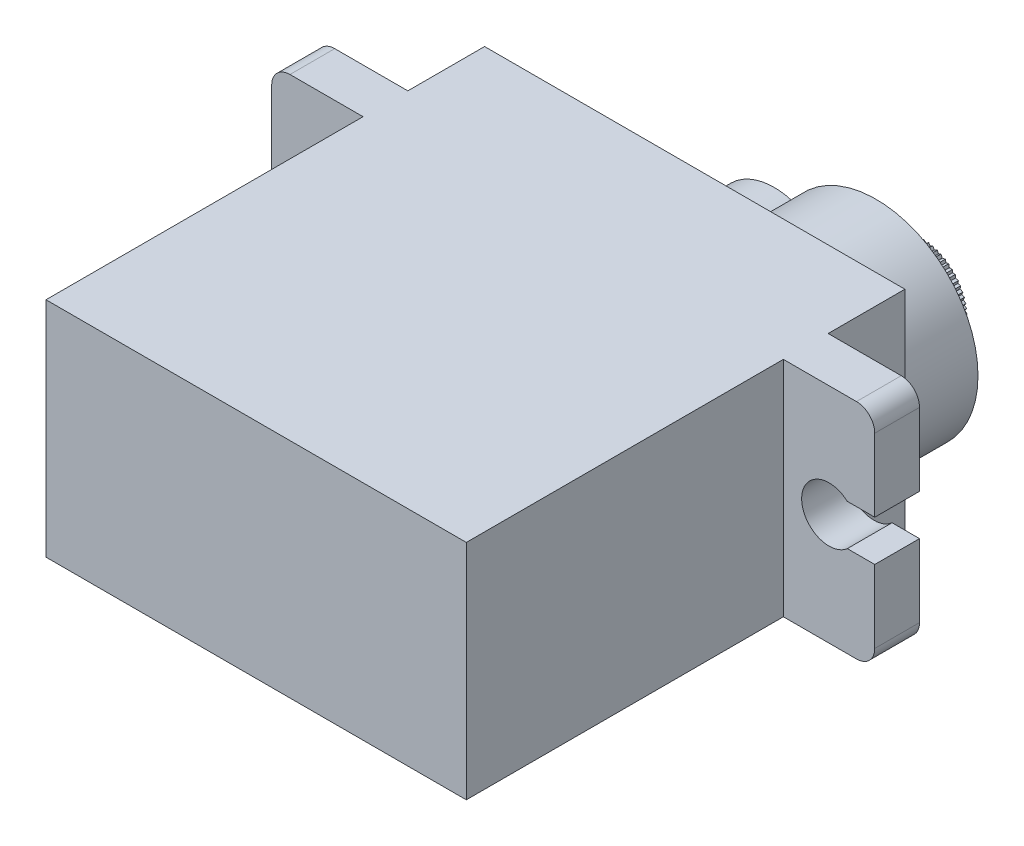
from build123d import *

# Parameters (mm, degrees)
IZIM1_W                      = 23
IZIM1_H                      = 12.2
Y_KSEKLIK_EKSTR_ZYON1_DEPTH  = 17.35
IZIM4_W                      = 2.45
IZIM4_H                      = 12.2
Y_KSEKLIK_EKSTR_ZYON2_DEPTH  = 5
IZIM5_W                      = 2.45
IZIM5_H                      = 12.2
Y_KSEKLIK_EKSTR_ZYON3_DEPTH  = 5
IZIM7_W                      = 23
IZIM7_H                      = 12.2
Y_KSEKLIK_EKSTR_ZYON4_DEPTH  = 6.65
IZIM8_R                      = 1.5
KES_EKSTR_ZYON1_DEPTH        = 2.45
RADYUS1_R                    = 1
KES_EKSTR_ZYON2_REACH        = 39.779
KES_EKSTR_ZYON2_END_RADIUS   = 1.5
IZIM6_W                      = 2.45
IZIM6_H                      = 2.24
KES_EKSTR_ZYON3_REACH        = 39.779
KES_EKSTR_ZYON3_END_RADIUS   = 1.5
IZIM9_W                      = 2.45
IZIM9_H                      = 2.24
IZIM10_R                     = 5.575
Y_KSEKLIK_EKSTR_ZYON5_DEPTH  = 4
IZIM11_R                     = 2.5
Y_KSEKLIK_EKSTR_ZYON6_DEPTH  = 2.5
IZIM12_R                     = 3.35
Y_KSEKLIK_EKSTR_ZYON7_DEPTH  = 4
KES_EKSTR_ZYON4_START        = -2.5
IZIM13_R                     = 2.5
KES_EKSTR_ZYON4_DEPTH        = 2.5
IZIM14_R                     = 0.75
KES_EKSTR_ZYON5_DEPTH        = 1
IZIM15_W                     = 19
IZIM15_H                     = 13.35
Y_KSEKLIK_EKSTR_ZYON8_DEPTH  = 0.1
IZIM17_W                     = 19
IZIM17_H                     = 3.5
Y_KSEKLIK_EKSTR_ZYON9_DEPTH  = 0.05
KES_EKSTR_ZYON7_DEPTH        = 0.05
IZIM19_W                     = 0.134615385
IZIM19_H                     = 1.5
KES_EKSTR_ZYON8_DEPTH        = 0.1
IZIM21_W                     = 19.5
IZIM21_H                     = 13.85
IZIM21_W_2                   = 19
IZIM21_H_2                   = 13.35
Y_KSEKLIK_EKSTR_ZYON10_DEPTH = 0.11
IZIM22_W                     = 20
IZIM22_H                     = 14.35
IZIM22_W_2                   = 19.5
IZIM22_H_2                   = 13.85
Y_KSEKLIK_EKSTR_ZYON11_DEPTH = 0.1


with BuildPart() as part:
    # Çizim1 → Yükseklik-Ekstrüzyon1 (new body)
    with BuildSketch(Plane.XY):
        Rectangle(IZIM1_W, IZIM1_H)
    extrude(amount=Y_KSEKLIK_EKSTR_ZYON1_DEPTH)



with BuildPart() as body_2:
    # Çizim4 → Yükseklik-Ekstrüzyon2 (new body)
    with BuildSketch(Plane(origin=(11.5, 0, 0), x_dir=(0, 0, -1), z_dir=(1, 0, 0))):
        with Locations((1.225, 0)):
            Rectangle(IZIM4_W, IZIM4_H)
    extrude(amount=Y_KSEKLIK_EKSTR_ZYON2_DEPTH)


with BuildPart() as body_3:
    # Çizim5 → Yükseklik-Ekstrüzyon3 (new body)
    with BuildSketch(Plane.ZY.offset(11.5)):
        with Locations((-1.225, 0)):
            Rectangle(IZIM5_W, IZIM5_H)
    extrude(amount=Y_KSEKLIK_EKSTR_ZYON3_DEPTH)


with BuildPart() as part_1:
    add(part.part)

    add(body_2.part)  # Yükseklik-Ekstrüzyon4 merges body 2

    add(body_3.part)  # Yükseklik-Ekstrüzyon4 merges body 3
    # Çizim7 → Yükseklik-Ekstrüzyon4 (add)
    with BuildSketch(Plane(origin=(0, 0, 0), x_dir=(-1, 0, 0), z_dir=(0, 0, -1))):
        Rectangle(IZIM7_W, IZIM7_H)
    extrude(amount=Y_KSEKLIK_EKSTR_ZYON4_DEPTH)

    # Çizim8 → Kes-Ekstrüzyon1 (cut)
    with BuildSketch(Plane(origin=(0, 0, -2.45), x_dir=(-1, 0, 0), z_dir=(0, 0, -1))):
        with Locations(Location((-14, 0, 0), (0, 0, 90))):
            Circle(IZIM8_R)
        with Locations(Location((14, 0, 0), (0, 0, 90))):
            Circle(IZIM8_R)
    extrude(amount=-KES_EKSTR_ZYON1_DEPTH, mode=Mode.SUBTRACT)

    # Radyus1
    radyus1_edges = [part_1.edges().sort_by_distance(p)[0] for p in [
        (16.5, -6.1, -1.225),
        (16.5, 6.1, -1.225),
        (-16.5, 6.1, -1.225),
        (-16.5, -6.1, -1.225),
    ]]
    fillet(radyus1_edges, radius=RADYUS1_R)

    # Kes-Ekstrüzyon2: up to this cylinder (the profile starts outside it)
    kes_ekstr_zyon2_end = Plane(origin=(14, 0, -1.225), z_dir=(0, 0, -1)) * Cylinder(KES_EKSTR_ZYON2_END_RADIUS, 83.558, mode=Mode.PRIVATE)
    # Çizim6 → Kes-Ekstrüzyon2 (cut, up to the surface)
    with BuildSketch(Plane(origin=(16.5, 0, 0), x_dir=(0, 0, -1), z_dir=(1, 0, 0)), mode=Mode.PRIVATE) as kes_ekstr_zyon2_sk1:
        with Locations((1.225, 0)):
            Rectangle(IZIM6_W, IZIM6_H)
    kes_ekstr_zyon2_tool1 = extrude(kes_ekstr_zyon2_sk1.sketch, amount=-KES_EKSTR_ZYON2_REACH, mode=Mode.PRIVATE) - kes_ekstr_zyon2_end
    add(kes_ekstr_zyon2_tool1.solids().sort_by_distance((16.5, 0, -1.225))[0], mode=Mode.SUBTRACT)

    # Kes-Ekstrüzyon3: up to this cylinder (the profile starts outside it)
    kes_ekstr_zyon3_end = Plane(origin=(-14, 0, -1.225), z_dir=(0, 0, -1)) * Cylinder(KES_EKSTR_ZYON3_END_RADIUS, 83.558, mode=Mode.PRIVATE)
    # Çizim9 → Kes-Ekstrüzyon3 (cut, up to the surface)
    with BuildSketch(Plane.ZY.offset(16.5), mode=Mode.PRIVATE) as kes_ekstr_zyon3_sk1:
        with Locations((-1.225, 0)):
            Rectangle(IZIM9_W, IZIM9_H)
    kes_ekstr_zyon3_tool1 = extrude(kes_ekstr_zyon3_sk1.sketch, amount=-KES_EKSTR_ZYON3_REACH, mode=Mode.PRIVATE) - kes_ekstr_zyon3_end
    add(kes_ekstr_zyon3_tool1.solids().sort_by_distance((-16.5, 0, -1.225))[0], mode=Mode.SUBTRACT)

    # Çizim10 → Yükseklik-Ekstrüzyon5 (add)
    with BuildSketch(Plane(origin=(0, 0, -6.65), x_dir=(-1, 0, 0), z_dir=(0, 0, -1))):
        with Locations(Location((-5.925, 0, 0), (0, 0, 180))):
            Circle(IZIM10_R)
    extrude(amount=Y_KSEKLIK_EKSTR_ZYON5_DEPTH)

    # Çizim11 → Yükseklik-Ekstrüzyon6 (add)
    with BuildSketch(Plane(origin=(0, 0, -10.65), x_dir=(-1, 0, 0), z_dir=(0, 0, -1))):
        with Locations((-5.925, 0)):
            Circle(IZIM11_R)
    extrude(amount=Y_KSEKLIK_EKSTR_ZYON6_DEPTH)

    # Çizim12 → Yükseklik-Ekstrüzyon7 (add)
    with BuildSketch(Plane(origin=(0, 0, -6.65), x_dir=(-1, 0, 0), z_dir=(0, 0, -1))):
        with Locations((-0.35, 0)):
            Circle(IZIM12_R)
    extrude(amount=Y_KSEKLIK_EKSTR_ZYON7_DEPTH)

    # Çizim13 → Kes-Ekstrüzyon4 (cut)
    with BuildSketch(Plane(origin=(0, 0, -13.15), x_dir=(-1, 0, 0), z_dir=(0, 0, -1)).offset(KES_EKSTR_ZYON4_START)):
        with Locations((-5.925, 0)):
            Circle(IZIM13_R)
        Polygon((-5.925, 2.375), (-5.815041215, 2.484958785), (-5.693802534, 2.363720104), (-5.690616156, 2.363406273), (-5.548054549, 2.458662894), (-5.461660485, 2.329365041), (-5.332362632, 2.415759104), (-5.237106012, 2.273197497), (-5.234042085, 2.272268065), (-5.075636114, 2.337881966), (-5.016126848, 2.19421389), (-4.872458772, 2.253723155), (-4.80684487, 2.095317185), (-4.804021139, 2.093807869), (-4.635858257, 2.127257546), (-4.605520697, 1.974740329), (-4.45300348, 2.00507789), (-4.419553803, 1.836915009), (-4.417078782, 1.834883811), (-4.245621395, 1.834883811), (-4.245621395, 1.679378605), (-4.090116189, 1.679378605), (-4.090116189, 1.507921218), (-4.088084992, 1.505446197), (-3.91992211, 1.47199652), (-3.950259671, 1.319479303), (-3.797742454, 1.289141743), (-3.831192131, 1.120978862), (-3.829682815, 1.11815513), (-3.671276844, 1.052541229), (-3.73078611, 0.908873152), (-3.587118034, 0.849363886), (-3.652731935, 0.690957916), (-3.651802503, 0.687893988), (-3.509240896, 0.592637368), (-3.595634959, 0.463339515), (-3.466337106, 0.376945452), (-3.561593727, 0.234383845), (-3.561279896, 0.231197466), (-3.440041215, 0.109958785), (-3.55, 0), (-3.440041215, -0.109958785), (-3.561279896, -0.231197466), (-3.561593727, -0.234383844), (-3.466337106, -0.376945451), (-3.595634959, -0.463339515), (-3.509240896, -0.592637368), (-3.651802503, -0.687893988), (-3.652731935, -0.690957915), (-3.587118034, -0.849363886), (-3.73078611, -0.908873152), (-3.671276845, -1.052541228), (-3.829682815, -1.11815513), (-3.831192131, -1.120978861), (-3.797742454, -1.289141743), (-3.950259671, -1.319479303), (-3.91992211, -1.47199652), (-4.088084991, -1.505446197), (-4.090116189, -1.507921218), (-4.090116189, -1.679378605), (-4.245621395, -1.679378605), (-4.245621395, -1.834883811), (-4.417078782, -1.834883811), (-4.419553803, -1.836915008), (-4.45300348, -2.00507789), (-4.605520697, -1.974740329), (-4.635858257, -2.127257546), (-4.804021138, -2.093807869), (-4.80684487, -2.095317185), (-4.872458771, -2.253723156), (-5.016126848, -2.19421389), (-5.075636114, -2.337881966), (-5.234042084, -2.272268065), (-5.237106012, -2.273197497), (-5.332362632, -2.415759104), (-5.461660485, -2.329365041), (-5.548054548, -2.458662894), (-5.690616155, -2.363406273), (-5.693802534, -2.363720104), (-5.815041215, -2.484958785), (-5.925, -2.375), (-6.034958785, -2.484958785), (-6.156197466, -2.363720104), (-6.159383844, -2.363406273), (-6.301945451, -2.458662894), (-6.388339515, -2.329365041), (-6.517637368, -2.415759104), (-6.612893988, -2.273197497), (-6.615957915, -2.272268065), (-6.774363886, -2.337881966), (-6.833873152, -2.19421389), (-6.977541228, -2.253723155), (-7.04315513, -2.095317185), (-7.045978861, -2.093807869), (-7.214141743, -2.127257546), (-7.244479303, -1.974740329), (-7.39699652, -2.00507789), (-7.430446197, -1.836915009), (-7.432921218, -1.834883811), (-7.604378605, -1.834883811), (-7.604378605, -1.679378605), (-7.759883811, -1.679378605), (-7.759883811, -1.507921218), (-7.761915008, -1.505446197), (-7.93007789, -1.47199652), (-7.899740329, -1.319479303), (-8.052257546, -1.289141743), (-8.018807869, -1.120978862), (-8.020317185, -1.11815513), (-8.178723156, -1.052541229), (-8.11921389, -0.908873152), (-8.262881966, -0.849363886), (-8.197268065, -0.690957916), (-8.198197497, -0.687893988), (-8.340759104, -0.592637368), (-8.254365041, -0.463339515), (-8.383662894, -0.376945452), (-8.288406273, -0.234383845), (-8.288720104, -0.231197466), (-8.409958785, -0.109958785), (-8.3, 0), (-8.409958785, 0.109958785), (-8.288720104, 0.231197466), (-8.288406273, 0.234383844), (-8.383662894, 0.376945451), (-8.254365041, 0.463339515), (-8.340759104, 0.592637368), (-8.198197497, 0.687893988), (-8.197268065, 0.690957915), (-8.262881966, 0.849363886), (-8.11921389, 0.908873152), (-8.178723155, 1.052541228), (-8.020317185, 1.11815513), (-8.018807869, 1.120978861), (-8.052257546, 1.289141743), (-7.899740329, 1.319479303), (-7.93007789, 1.47199652), (-7.761915009, 1.505446197), (-7.759883811, 1.507921218), (-7.759883811, 1.679378605), (-7.604378605, 1.679378605), (-7.604378605, 1.834883811), (-7.432921218, 1.834883811), (-7.430446197, 1.836915008), (-7.39699652, 2.00507789), (-7.244479303, 1.974740329), (-7.214141743, 2.127257546), (-7.045978862, 2.093807869), (-7.04315513, 2.095317185), (-6.977541229, 2.253723156), (-6.833873152, 2.19421389), (-6.774363886, 2.337881966), (-6.615957916, 2.272268065), (-6.612893988, 2.273197497), (-6.517637368, 2.415759104), (-6.388339515, 2.329365041), (-6.301945452, 2.458662894), (-6.159383845, 2.363406273), (-6.156197466, 2.363720104), (-6.034958785, 2.484958785), align=None, mode=Mode.SUBTRACT)
    extrude(amount=KES_EKSTR_ZYON4_DEPTH, mode=Mode.SUBTRACT)

    # Çizim14 → Kes-Ekstrüzyon5 (cut)
    with BuildSketch(Plane(origin=(0, 0, -13.15), x_dir=(-1, 0, 0), z_dir=(0, 0, -1))):
        with Locations((-5.925, 0)):
            Circle(IZIM14_R)
    extrude(amount=-KES_EKSTR_ZYON5_DEPTH, mode=Mode.SUBTRACT)

    # Çizim15 → Yükseklik-Ekstrüzyon8 (add)
    with BuildSketch(Plane.XZ.offset(6.1)):
        with Locations((0, 8.675)):
            Rectangle(IZIM15_W, IZIM15_H)
    extrude(amount=Y_KSEKLIK_EKSTR_ZYON8_DEPTH)

    # Çizim17 → Yükseklik-Ekstrüzyon9 (add)
    with BuildSketch(Plane.XZ.offset(6.2)):
        with Locations((0, 8.675)):
            Rectangle(IZIM17_W, IZIM17_H)
    extrude(amount=Y_KSEKLIK_EKSTR_ZYON9_DEPTH)

    # Çizim18 → Kes-Ekstrüzyon7 (cut)
    # profile 1 of 5: a face of its own
    with BuildSketch(Plane.XZ.offset(6.25)):
        with BuildLine():
            Line((-2.528846154, 9.135637019), (-2.655649038, 9.059615385))
            add(Edge.make_bspline(
                [(-2.655649038, 9.059615385), (-2.667442569, 9.079357264), (-2.690038518, 9.117181943), (-2.727731957, 9.168292531), (-2.766788919, 9.211733456), (-2.807498633, 9.247252002), (-2.849612611, 9.27521581), (-2.893405777, 9.295016767), (-2.938730553, 9.307366471), (-2.969576477, 9.308866508), (-2.984975962, 9.309615385)],
                knots=[0, 0, 0, 0, 1.272034388, 2.437168799, 3.508375237, 4.49857839, 5.41946034, 6.295179144, 7.148887113, 8, 8, 8, 8], degree=3))
            add(Edge.make_bspline(
                [(-2.984975962, 9.309615385), (-2.998124812, 9.309240383), (-3.024192439, 9.30849694), (-3.062643376, 9.301642019), (-3.09980017, 9.290427418), (-3.135293008, 9.275224683), (-3.168183207, 9.256537675), (-3.197482751, 9.23450058), (-3.222238833, 9.209043194), (-3.242705398, 9.181083406), (-3.258726964, 9.151204851), (-3.27012669, 9.120143358), (-3.277449626, 9.088096859), (-3.27837807, 9.066364992), (-3.278846154, 9.055408654)],
                knots=[0, 0, 0, 0, 1.095645842, 2.172120455, 3.244862764, 4.326153987, 5.384857088, 6.392105572, 7.372507978, 8.334705661, 9.272564127, 10.189475455, 11.087205874, 12, 12, 12, 12], degree=3))
            add(Edge.make_bspline(
                [(-3.278846154, 9.055408654), (-3.278227877, 9.04291555), (-3.276975799, 9.017615652), (-3.265941155, 8.980224759), (-3.249091714, 8.943062361), (-3.233255134, 8.920070694), (-3.225060096, 8.908173077)],
                knots=[0, 0, 0, 0, 0.938992559, 1.901562324, 2.914110574, 4, 4, 4, 4], degree=3))
            add(Edge.make_bspline(
                [(-3.225060096, 8.908173077), (-3.218364119, 8.899562929), (-3.204265488, 8.881433942), (-3.179670944, 8.854922208), (-3.151705399, 8.826851175), (-3.119644813, 8.797781136), (-3.083956699, 8.76711744), (-3.044236455, 8.735428783), (-3.000947876, 8.702242541), (-2.97041518, 8.680323982), (-2.954627404, 8.668990385)],
                knots=[0, 0, 0, 0, 0.722283655, 1.520795216, 2.39349503, 3.346893347, 4.386874146, 5.510198126, 6.712579003, 8, 8, 8, 8], degree=3))
            add(Edge.make_bspline(
                [(-2.954627404, 8.668990385), (-2.938847796, 8.657746988), (-2.908678388, 8.636250471), (-2.866454638, 8.604387612), (-2.828747934, 8.575070261), (-2.795366141, 8.548706797), (-2.767172889, 8.524147382), (-2.743137512, 8.502708261), (-2.724146765, 8.483244611), (-2.713578862, 8.470628338), (-2.708834135, 8.464963942)],
                knots=[0, 0, 0, 0, 1.452255772, 2.776602448, 3.96446981, 5.032613149, 5.964194703, 6.766668629, 7.446264616, 8, 8, 8, 8], degree=3))
            add(Edge.make_bspline(
                [(-2.708834135, 8.464963942), (-2.702204155, 8.456134488), (-2.689165411, 8.438770182), (-2.671935571, 8.411637203), (-2.6574056, 8.383915023), (-2.645711689, 8.355503172), (-2.636255267, 8.32661518), (-2.629680628, 8.29703417), (-2.625628159, 8.266960953), (-2.625209551, 8.246727297), (-2.625, 8.236598558)],
                knots=[0, 0, 0, 0, 1.068019517, 2.100403715, 3.106014851, 4.09224787, 5.069873182, 6.043214339, 7.020455327, 8, 8, 8, 8], degree=3))
            add(Edge.make_bspline(
                [(-2.625, 8.236598558), (-2.62555691, 8.220727295), (-2.626658828, 8.189324005), (-2.636054812, 8.143473378), (-2.650710018, 8.099562574), (-2.671912741, 8.05856889), (-2.698102071, 8.020550437), (-2.729188856, 7.98618163), (-2.765755263, 7.956645485), (-2.806463012, 7.931537401), (-2.850500406, 7.91150675), (-2.896781125, 7.896911162), (-2.945097207, 7.888357257), (-2.977931196, 7.887150684), (-2.994591346, 7.886538462)],
                knots=[0, 0, 0, 0, 1.005367131, 1.989245246, 2.955191616, 3.932180104, 4.904534562, 5.875498653, 6.859376768, 7.874484044, 8.900379497, 9.918679785, 10.943926428, 12, 12, 12, 12], degree=3))
            add(Edge.make_bspline(
                [(-2.994591346, 7.886538462), (-3.012272852, 7.887128476), (-3.047337392, 7.888298545), (-3.098930759, 7.89909769), (-3.148901262, 7.915876741), (-3.188948699, 7.935860268), (-3.220303248, 7.955603961), (-3.244189318, 7.973632915), (-3.268526373, 7.994343806), (-3.293052191, 8.018175388), (-3.318009093, 8.044650376), (-3.343282062, 8.073993069), (-3.369107628, 8.105938987), (-3.385716349, 8.128750463), (-3.394230769, 8.140444712)],
                knots=[0, 0, 0, 0, 1.286534051, 2.551350862, 3.822568981, 5.117864672, 5.799956111, 6.519305446, 7.295594771, 8.126302591, 9.008831062, 9.944975596, 10.946496709, 12, 12, 12, 12], degree=3))
            Line((-3.394230769, 8.140444712), (-3.272536058, 8.232692308))
            add(Edge.make_bspline(
                [(-3.272536058, 8.232692308), (-3.265188337, 8.223225178), (-3.251038344, 8.2049937), (-3.229547151, 8.179470427), (-3.209321883, 8.156124371), (-3.189242599, 8.135899885), (-3.170857074, 8.117282255), (-3.15269572, 8.101625967), (-3.135460135, 8.088433981), (-3.113784468, 8.074337216), (-3.08625631, 8.060698492), (-3.052022447, 8.04897244), (-3.016223476, 8.041766085), (-2.991920346, 8.040850167), (-2.979567308, 8.040384615)],
                knots=[0, 0, 0, 0, 1.181426797, 2.275151783, 3.28963443, 4.225459815, 5.084396437, 5.868484344, 6.587427557, 7.222918358, 8.415355282, 9.605213164, 10.782753814, 12, 12, 12, 12], degree=3))
            add(Edge.make_bspline(
                [(-2.979567308, 8.040384615), (-2.964067998, 8.040895412), (-2.934179041, 8.041880435), (-2.89184433, 8.052921453), (-2.853520853, 8.069708576), (-2.820671601, 8.093915432), (-2.793548482, 8.122774667), (-2.773685184, 8.155686592), (-2.761809267, 8.192036533), (-2.760355675, 8.217380955), (-2.759615385, 8.230288462)],
                knots=[0, 0, 0, 0, 1.144248881, 2.206576175, 3.214949548, 4.222996039, 5.203671638, 6.127710127, 7.046472867, 8, 8, 8, 8], degree=3))
            add(Edge.make_bspline(
                [(-2.759615385, 8.230288462), (-2.759801454, 8.238320855), (-2.760176185, 8.254497536), (-2.764643888, 8.278348349), (-2.771310998, 8.301918382), (-2.780761442, 8.325343434), (-2.793604708, 8.349290865), (-2.811048117, 8.373624177), (-2.832876234, 8.398952372), (-2.84962874, 8.415409624), (-2.858473558, 8.424098558)],
                knots=[0, 0, 0, 0, 0.858500039, 1.728959331, 2.587258638, 3.476905708, 4.426389682, 5.487945037, 6.673710648, 8, 8, 8, 8], degree=3))
            add(Edge.make_bspline(
                [(-2.858473558, 8.424098558), (-2.861757003, 8.427028712), (-2.869557717, 8.433990087), (-2.883818829, 8.445386778), (-2.902651456, 8.459445109), (-2.925563828, 8.476839674), (-2.952978412, 8.497017443), (-2.984898222, 8.51972042), (-3.02096745, 8.545685616), (-3.046562557, 8.563838848), (-3.060096154, 8.5734375)],
                knots=[0, 0, 0, 0, 0.420754252, 0.999615792, 1.744751191, 2.668019286, 3.750313428, 4.999500688, 6.413464383, 8, 8, 8, 8], degree=3))
            add(Edge.make_bspline(
                [(-3.060096154, 8.5734375), (-3.076375819, 8.585283805), (-3.107899136, 8.608222534), (-3.15275254, 8.642686283), (-3.193420782, 8.676392858), (-3.230049657, 8.709124816), (-3.262990952, 8.740641192), (-3.2919126, 8.771296722), (-3.316945827, 8.800890372), (-3.344263935, 8.838573267), (-3.371847126, 8.885282594), (-3.395497445, 8.942536127), (-3.410543373, 8.999953958), (-3.412497424, 9.038495774), (-3.413461538, 9.057512019)],
                knots=[0, 0, 0, 0, 1.163604038, 2.253157948, 3.268574773, 4.215621239, 5.091738613, 5.902582348, 6.650434646, 7.330118262, 8.591011492, 9.77460283, 10.902005569, 12, 12, 12, 12], degree=3))
            add(Edge.make_bspline(
                [(-3.413461538, 9.057512019), (-3.413179464, 9.070959641), (-3.412620793, 9.097593742), (-3.406215424, 9.136706675), (-3.396797291, 9.174677892), (-3.382760696, 9.21103486), (-3.365214544, 9.24618278), (-3.343852245, 9.280060023), (-3.317963571, 9.312109951), (-3.28920436, 9.342954983), (-3.257260153, 9.370851264), (-3.22345666, 9.395698044), (-3.187983612, 9.416972411), (-3.150435913, 9.433686026), (-3.111432076, 9.447055489), (-3.070789014, 9.456638369), (-3.028419392, 9.462539815), (-2.999618769, 9.463150867), (-2.984975962, 9.463461538)],
                knots=[0, 0, 0, 0, 0.98378539, 1.948466333, 2.894822735, 3.844243623, 4.795447569, 5.768042124, 6.770299647, 7.807997672, 8.852593179, 9.870666288, 10.876941106, 11.874841786, 12.874492863, 13.892063892, 14.928283473, 16, 16, 16, 16], degree=3))
            add(Edge.make_bspline(
                [(-2.984975962, 9.463461538), (-2.973647029, 9.46323995), (-2.95113184, 9.462799565), (-2.91791854, 9.458998509), (-2.88531514, 9.453424212), (-2.853731004, 9.444925436), (-2.822772889, 9.43437128), (-2.792716609, 9.421449339), (-2.763489659, 9.406066062), (-2.735055937, 9.388197654), (-2.707155192, 9.367599575), (-2.67990003, 9.343816922), (-2.653154011, 9.316963533), (-2.626806035, 9.287076777), (-2.601476763, 9.253662649), (-2.57652924, 9.217251055), (-2.552093367, 9.177724366), (-2.536739961, 9.149928169), (-2.528846154, 9.135637019)],
                knots=[0, 0, 0, 0, 0.915366252, 1.81920441, 2.69897508, 3.586533125, 4.459536084, 5.340758185, 6.227946952, 7.126403341, 8.052553006, 9.028121456, 10.047063623, 11.114014537, 12.24582441, 13.433687931, 14.680555077, 16, 16, 16, 16], degree=3))
        make_face()
    # profile 2 of 5: a face of its own
    with BuildSketch(Plane.XZ.offset(6.25)):
        with BuildLine():
            add(Edge.make_bspline(
                [(-1.394230769, 8.675600962), (-1.394371348, 8.651559224), (-1.394644426, 8.604857802), (-1.39768232, 8.536807241), (-1.402728895, 8.472967117), (-1.409644914, 8.413334376), (-1.418061186, 8.357893615), (-1.42929641, 8.30679302), (-1.442073273, 8.259795996), (-1.45688164, 8.21674957), (-1.473590087, 8.177072838), (-1.491778335, 8.14003549), (-1.512155673, 8.10568177), (-1.533601425, 8.073505519), (-1.55686615, 8.043830547), (-1.581868947, 8.01679022), (-1.608389588, 7.991965508), (-1.636553562, 7.969764621), (-1.666092431, 7.95041951), (-1.696132396, 7.932883604), (-1.727530259, 7.919012218), (-1.759511575, 7.907150586), (-1.792334009, 7.897754571), (-1.826011861, 7.891218904), (-1.86057535, 7.887130052), (-1.883902711, 7.886737529), (-1.895733173, 7.886538462)],
                knots=[0, 0, 0, 0, 1.64625301, 3.197870201, 4.6634513, 6.030635694, 7.308242971, 8.501545196, 9.611429483, 10.641742253, 11.616230371, 12.55791849, 13.464870342, 14.34944951, 15.20427819, 16.044004467, 16.869007726, 17.689551165, 18.496129964, 19.285613293, 20.0683943, 20.843080271, 21.620342827, 22.403213977, 23.190190624, 24, 24, 24, 24], degree=3))
            add(Edge.make_bspline(
                [(-1.895733173, 7.886538462), (-1.907668449, 7.886703997), (-1.931415448, 7.887033355), (-1.966397655, 7.891669263), (-2.000770531, 7.897652964), (-2.034012572, 7.907249834), (-2.066752321, 7.918733734), (-2.098175607, 7.933886558), (-2.129391838, 7.950366431), (-2.158982902, 7.970470489), (-2.187832925, 7.992688782), (-2.21487681, 8.017912225), (-2.240805871, 8.045442755), (-2.264640776, 8.075894386), (-2.287403057, 8.108800201), (-2.308228635, 8.144436049), (-2.327550643, 8.182722953), (-2.345732284, 8.223483422), (-2.361631649, 8.267806232), (-2.375767456, 8.315414928), (-2.387354142, 8.366740632), (-2.396936127, 8.421497425), (-2.404373571, 8.479956573), (-2.409786418, 8.54199963), (-2.412646636, 8.607665412), (-2.413185177, 8.652561647), (-2.413461538, 8.675600962)],
                knots=[0, 0, 0, 0, 0.810910589, 1.61342667, 2.396193133, 3.181089899, 3.963115317, 4.752255436, 5.550715454, 6.36105385, 7.181178335, 8.024612154, 8.872680183, 9.750181803, 10.651284446, 11.591556747, 12.554036451, 13.566402641, 14.62422919, 15.753422176, 16.94128843, 18.199818041, 19.531985927, 20.947085226, 22.433341622, 24, 24, 24, 24], degree=3))
            add(Edge.make_bspline(
                [(-2.413461538, 8.675600962), (-2.413178753, 8.698539493), (-2.412626522, 8.743334333), (-2.409851512, 8.808708914), (-2.404228471, 8.870413418), (-2.397375, 8.928537244), (-2.387493636, 8.983004416), (-2.376492725, 9.034107441), (-2.362460446, 9.081366147), (-2.34693821, 9.125309031), (-2.329009554, 9.165896836), (-2.309833063, 9.204025704), (-2.288696607, 9.23945931), (-2.266371092, 9.2725737), (-2.242084945, 9.302764169), (-2.216506782, 9.330602662), (-2.189200529, 9.355869927), (-2.160201993, 9.378350558), (-2.130331241, 9.398606059), (-2.099108925, 9.415673554), (-2.06726593, 9.430552926), (-2.034471049, 9.442514202), (-2.000933405, 9.451969637), (-1.966532224, 9.458406376), (-1.93141077, 9.462943466), (-1.907666884, 9.46328825), (-1.895733173, 9.463461538)],
                knots=[0, 0, 0, 0, 1.561431216, 3.049195289, 4.452146966, 5.778046447, 7.031138842, 8.218704273, 9.334037798, 10.384210803, 11.388620812, 12.352076869, 13.287433199, 14.19507451, 15.06813243, 15.922055533, 16.766344942, 17.596869952, 18.417486629, 19.220035357, 20.016159057, 20.807716045, 21.59340902, 22.384936649, 23.188266813, 24, 24, 24, 24], degree=3))
            add(Edge.make_bspline(
                [(-1.895733173, 9.463461538), (-1.883903124, 9.463260706), (-1.860576576, 9.462864705), (-1.82600713, 9.458801336), (-1.79237811, 9.45217535), (-1.759622286, 9.443177295), (-1.72767263, 9.431741297), (-1.696842091, 9.417195148), (-1.666723619, 9.400323813), (-1.637454204, 9.381129757), (-1.609593389, 9.359132935), (-1.582975092, 9.334808631), (-1.558296027, 9.30752998), (-1.535191744, 9.277732371), (-1.513568051, 9.245475121), (-1.493277005, 9.210858405), (-1.475144146, 9.17346025), (-1.458056855, 9.13356813), (-1.442994278, 9.090205411), (-1.429841913, 9.043047335), (-1.418753273, 8.991772241), (-1.409921016, 8.936377674), (-1.402685429, 8.87694939), (-1.397687295, 8.813392685), (-1.394645944, 8.745843693), (-1.394371686, 8.699442475), (-1.394230769, 8.675600962)],
                knots=[0, 0, 0, 0, 0.810976328, 1.599087026, 2.383086309, 3.159618043, 3.926613167, 4.707144544, 5.494386734, 6.292609454, 7.104690378, 7.92621526, 8.762510248, 9.62398222, 10.509836085, 11.424023232, 12.373226806, 13.358118208, 14.398657954, 15.5185989, 16.713620699, 17.994156382, 19.364120462, 20.818119981, 22.365111093, 24, 24, 24, 24], degree=3))
        make_face()
        with BuildLine():
            add(Edge.make_bspline(
                [(-1.528846154, 8.675), (-1.528898468, 8.695035077), (-1.528999999, 8.733919226), (-1.531575674, 8.790324722), (-1.53516075, 8.843022522), (-1.539670984, 8.891992057), (-1.546425694, 8.937062187), (-1.554089344, 8.978420263), (-1.563281365, 9.015989799), (-1.574210999, 9.050098888), (-1.586660259, 9.081231272), (-1.600231056, 9.110214168), (-1.614931163, 9.137400109), (-1.631097843, 9.162691009), (-1.648962718, 9.185945612), (-1.668127039, 9.207274363), (-1.68870224, 9.226590415), (-1.717178277, 9.249514655), (-1.754589075, 9.273482774), (-1.801966109, 9.294097633), (-1.850669606, 9.307136495), (-1.883735948, 9.308790046), (-1.900240385, 9.309615385)],
                knots=[0, 0, 0, 0, 1.459193451, 2.832007961, 4.111736495, 5.306635028, 6.412683014, 7.430020708, 8.369596877, 9.227877302, 10.036669781, 10.810175692, 11.557788084, 12.286326232, 12.994037279, 13.69140682, 14.37267704, 15.047194847, 16.352618509, 17.594157723, 18.799169539, 20, 20, 20, 20], degree=3))
            add(Edge.make_bspline(
                [(-1.900240385, 9.309615385), (-1.916839592, 9.308891676), (-1.949979127, 9.307446825), (-1.998649473, 9.294836739), (-2.045507967, 9.274336744), (-2.082488194, 9.250915986), (-2.110544022, 9.228468832), (-2.130652977, 9.209352541), (-2.149107676, 9.187941696), (-2.166611551, 9.164842327), (-2.182665405, 9.139611171), (-2.197263903, 9.112370093), (-2.210585335, 9.083043296), (-2.218174926, 9.062570551), (-2.222055288, 9.052103365)],
                knots=[0, 0, 0, 0, 1.353621445, 2.702441307, 4.075953605, 5.516772412, 6.261413105, 7.007624062, 7.778524365, 8.566925914, 9.372323995, 10.217594641, 11.088702136, 12, 12, 12, 12], degree=3))
            add(Edge.make_bspline(
                [(-2.222055288, 9.052103365), (-2.226577475, 9.038719191), (-2.235759452, 9.011543578), (-2.24759307, 8.969387727), (-2.256912526, 8.925157971), (-2.265296826, 8.879118635), (-2.271019564, 8.830930192), (-2.27562577, 8.780741742), (-2.278338921, 8.728515444), (-2.278675243, 8.693031876), (-2.278846154, 8.675)],
                knots=[0, 0, 0, 0, 0.884706709, 1.796334032, 2.740027952, 3.714592787, 4.726048262, 5.777819803, 6.87074269, 8, 8, 8, 8], degree=3))
            add(Edge.make_bspline(
                [(-2.278846154, 8.675), (-2.278657658, 8.656968511), (-2.278288874, 8.621690702), (-2.275865929, 8.570079234), (-2.271972458, 8.520973802), (-2.26670273, 8.474329858), (-2.259468509, 8.430230422), (-2.250780925, 8.388612395), (-2.240595746, 8.349486975), (-2.228912987, 8.312753331), (-2.215746868, 8.278543253), (-2.201201606, 8.246783096), (-2.185682081, 8.217301564), (-2.168814529, 8.190193481), (-2.150837599, 8.165300672), (-2.131105802, 8.143196152), (-2.110872486, 8.122804599), (-2.082096428, 8.099944166), (-2.044729848, 8.076451296), (-1.997912465, 8.055419844), (-1.949458493, 8.042972863), (-1.916634592, 8.041246743), (-1.900240385, 8.040384615)],
                knots=[0, 0, 0, 0, 1.313528337, 2.569860077, 3.762944266, 4.901481389, 5.988248151, 7.017139294, 7.997571128, 8.932104357, 9.823695246, 10.66607014, 11.475539426, 12.248954257, 12.990316782, 13.708962568, 14.405488541, 15.08007697, 16.381737273, 17.610043218, 18.806313575, 20, 20, 20, 20], degree=3))
            add(Edge.make_bspline(
                [(-1.900240385, 8.040384615), (-1.883646913, 8.041247763), (-1.850429741, 8.04297563), (-1.801468885, 8.055375929), (-1.754371233, 8.076301714), (-1.717083396, 8.099973217), (-1.688712447, 8.122715819), (-1.668523173, 8.142126149), (-1.649469767, 8.163255431), (-1.631690474, 8.186404598), (-1.615622432, 8.211647273), (-1.600743659, 8.238636132), (-1.587281134, 8.267575974), (-1.574784883, 8.298691151), (-1.563971218, 8.332856288), (-1.554248472, 8.370418332), (-1.546743976, 8.412045378), (-1.540080642, 8.457327156), (-1.53504392, 8.506354913), (-1.53160066, 8.559177461), (-1.528992176, 8.615779583), (-1.528895803, 8.654864493), (-1.528846154, 8.675)],
                knots=[0, 0, 0, 0, 1.207779899, 2.417760083, 3.652287919, 4.947299644, 5.621638849, 6.297435916, 6.984320042, 7.691843698, 8.42018894, 9.161205785, 9.934506883, 10.743085206, 11.601138371, 12.542248028, 13.566483018, 14.679455109, 15.87477181, 17.154161492, 18.533899613, 20, 20, 20, 20], degree=3))
        make_face(mode=Mode.SUBTRACT)
    # profile 3 of 5: a face of its own
    with BuildSketch(Plane.XZ.offset(6.25)):
        with BuildLine():
            Line((-0.567307692, 9.463461538), (-0.459735577, 9.388641827))
            Line((-0.459735577, 9.388641827), (-0.876802885, 8.778966346))
            add(Edge.make_bspline(
                [(-0.876802885, 8.778966346), (-0.850196248, 8.782372361), (-0.797820208, 8.789077214), (-0.74502575, 8.789953484), (-0.719050481, 8.790384615)],
                knots=[0, 0, 0, 0, 1.015985029, 2, 2, 2, 2], degree=3))
            add(Edge.make_bspline(
                [(-0.719050481, 8.790384615), (-0.703304324, 8.789980101), (-0.672395997, 8.789186074), (-0.626947665, 8.782928024), (-0.583212538, 8.773180379), (-0.541357196, 8.758972524), (-0.501418961, 8.740814497), (-0.463258324, 8.718695707), (-0.426926361, 8.692533565), (-0.392848504, 8.66261026), (-0.361863135, 8.629744771), (-0.334235503, 8.594972241), (-0.31139999, 8.557915382), (-0.292091826, 8.519356227), (-0.277859449, 8.478471643), (-0.267244919, 8.435955398), (-0.260781573, 8.391543567), (-0.260008104, 8.361319452), (-0.259615385, 8.345973558)],
                knots=[0, 0, 0, 0, 1.060682839, 2.082027659, 3.085691555, 4.076014095, 5.054630121, 6.037449673, 7.043289733, 8.066773124, 9.088474683, 10.083546559, 11.053653938, 12.01652662, 12.983553501, 13.964076119, 14.966286614, 16, 16, 16, 16], degree=3))
            add(Edge.make_bspline(
                [(-0.259615385, 8.345973558), (-0.260360208, 8.324987801), (-0.261822145, 8.283797019), (-0.273543105, 8.223599603), (-0.292962574, 8.166648869), (-0.319614785, 8.1130085), (-0.353827733, 8.063910615), (-0.394458143, 8.019521561), (-0.441834402, 7.980633173), (-0.494719594, 7.947242916), (-0.551795398, 7.920205525), (-0.611819442, 7.900996611), (-0.673780585, 7.888725508), (-0.715888752, 7.887270621), (-0.737079327, 7.886538462)],
                knots=[0, 0, 0, 0, 1.023011052, 2.007963168, 2.978169221, 3.950402619, 4.919353283, 5.887490769, 6.876420893, 7.899700203, 8.931203047, 9.947778163, 10.96723692, 12, 12, 12, 12], degree=3))
            add(Edge.make_bspline(
                [(-0.737079327, 7.886538462), (-0.757860881, 7.887320003), (-0.798923274, 7.888864255), (-0.859386486, 7.900273088), (-0.917348051, 7.919296903), (-0.972354197, 7.945706194), (-1.02301417, 7.979028528), (-1.068768237, 8.018391661), (-1.108220661, 8.064247587), (-1.141868303, 8.115191469), (-1.16837195, 8.170270623), (-1.187793134, 8.227652493), (-1.19966444, 8.286993702), (-1.20116552, 8.327189941), (-1.201923077, 8.347475962)],
                knots=[0, 0, 0, 0, 1.026310256, 2.027892329, 3.027798401, 4.032590076, 5.033095916, 6.015299856, 7.004484051, 8.011843335, 9.023241558, 10.015317641, 10.998381257, 12, 12, 12, 12], degree=3))
            add(Edge.make_bspline(
                [(-1.201923077, 8.347475962), (-1.20142209, 8.363223999), (-1.200405965, 8.395164953), (-1.193187176, 8.443561317), (-1.181311171, 8.492971797), (-1.167749131, 8.534885357), (-1.153653015, 8.569258812), (-1.141879288, 8.596922396), (-1.12752301, 8.625594306), (-1.111184824, 8.655481881), (-1.093668939, 8.687020486), (-1.073923589, 8.71962354), (-1.052365678, 8.753475345), (-1.037009855, 8.776295371), (-1.029146635, 8.787980769)],
                knots=[0, 0, 0, 0, 1.179744101, 2.39281581, 3.657884751, 4.98449437, 5.688244212, 6.441097573, 7.23650985, 8.089392143, 8.993247458, 9.939208743, 10.944735416, 12, 12, 12, 12], degree=3))
            Line((-1.029146635, 8.787980769), (-0.567307692, 9.463461538))
        make_face()
        with BuildLine():
            add(Edge.make_bspline(
                [(-0.743990385, 8.636538462), (-0.755918961, 8.636211908), (-0.779139845, 8.635576218), (-0.81316266, 8.631724478), (-0.84525873, 8.624844771), (-0.875634626, 8.615129664), (-0.904253576, 8.602822563), (-0.931124594, 8.587824345), (-0.955973204, 8.569806432), (-0.978887873, 8.549553937), (-0.999683631, 8.527358008), (-1.017614368, 8.50357713), (-1.033139141, 8.478950094), (-1.045524439, 8.452972749), (-1.055505722, 8.426070055), (-1.062470312, 8.397852945), (-1.066316951, 8.368516244), (-1.066973862, 8.348588478), (-1.067307692, 8.338461538)],
                knots=[0, 0, 0, 0, 1.163726718, 2.265380301, 3.334713825, 4.36057981, 5.371541381, 6.368955992, 7.355979581, 8.359691305, 9.348261197, 10.317521986, 11.261029684, 12.183096459, 13.119698615, 14.055740009, 15.011961376, 16, 16, 16, 16], degree=3))
            add(Edge.make_bspline(
                [(-1.067307692, 8.338461538), (-1.067020995, 8.328330092), (-1.066456024, 8.308364835), (-1.061914239, 8.278988689), (-1.053948269, 8.250825821), (-1.043144604, 8.223691703), (-1.029208913, 8.197707614), (-1.012261104, 8.172948912), (-0.992191622, 8.149324517), (-0.969323393, 8.127130434), (-0.944229532, 8.106736365), (-0.917404992, 8.089037556), (-0.889437888, 8.073824786), (-0.860010417, 8.06191469), (-0.829521961, 8.052137905), (-0.797637187, 8.04522163), (-0.764317396, 8.04136731), (-0.741696298, 8.040716352), (-0.730168269, 8.040384615)],
                knots=[0, 0, 0, 0, 0.97180342, 1.915057841, 2.843062057, 3.774592458, 4.711855407, 5.666109401, 6.64802866, 7.681008178, 8.719604906, 9.745767187, 10.760480799, 11.768803314, 12.78696958, 13.829338598, 14.893800474, 16, 16, 16, 16], degree=3))
            add(Edge.make_bspline(
                [(-0.730168269, 8.040384615), (-0.718740471, 8.040716836), (-0.696319224, 8.041368651), (-0.663296044, 8.045214914), (-0.63162539, 8.052182386), (-0.601231025, 8.0619195), (-0.571865623, 8.073758487), (-0.544121143, 8.089037199), (-0.517576103, 8.106830845), (-0.492489495, 8.127104165), (-0.469671324, 8.149431207), (-0.449254083, 8.172843649), (-0.432345089, 8.197720953), (-0.418389752, 8.22368818), (-0.407591284, 8.250826758), (-0.399623927, 8.278988436), (-0.395082515, 8.308364901), (-0.394517492, 8.328330115), (-0.394230769, 8.338461538)],
                knots=[0, 0, 0, 0, 1.099260809, 2.156740654, 3.192227907, 4.212865946, 5.223636336, 6.232338816, 7.252976855, 8.294094955, 9.329582207, 10.320135147, 11.276705756, 12.216244072, 13.150035923, 14.080293028, 15.025837361, 16, 16, 16, 16], degree=3))
            add(Edge.make_bspline(
                [(-0.394230769, 8.338461538), (-0.394490734, 8.348596333), (-0.395003432, 8.368584004), (-0.39993985, 8.39795458), (-0.408217121, 8.426098752), (-0.419192826, 8.453256768), (-0.433922539, 8.479077275), (-0.451823399, 8.503694163), (-0.472477936, 8.527610692), (-0.496563045, 8.549484537), (-0.522426288, 8.569903365), (-0.550206164, 8.587711056), (-0.579344424, 8.602643353), (-0.60965398, 8.615165942), (-0.641361628, 8.624746773), (-0.674423216, 8.631711699), (-0.708844699, 8.635539291), (-0.732162759, 8.636202209), (-0.743990385, 8.636538462)],
                knots=[0, 0, 0, 0, 0.952872936, 1.879239831, 2.791748947, 3.708674669, 4.628500839, 5.580394867, 6.568761142, 7.595635223, 8.636123962, 9.665976811, 10.694276597, 11.712685318, 12.747011694, 13.805940053, 14.887106426, 16, 16, 16, 16], degree=3))
        make_face(mode=Mode.SUBTRACT)
    # profile 4 of 5: a face of its own
    with BuildSketch(Plane.XZ.offset(6.25)):
        with BuildLine():
            Line((0.028846154, 8.181009615), (0.144230769, 8.290384615))
            add(Edge.make_bspline(
                [(0.144230769, 8.290384615), (0.165232554, 8.270769789), (0.20662383, 8.232111993), (0.27378306, 8.181394707), (0.343950215, 8.138286462), (0.416554833, 8.102869753), (0.490196822, 8.0753391), (0.563405919, 8.055432985), (0.635668858, 8.042630923), (0.683643428, 8.041127137), (0.707331731, 8.040384615)],
                knots=[0, 0, 0, 0, 1.091957225, 2.152079168, 3.193085318, 4.218301889, 5.218403563, 6.17723952, 7.099979378, 8, 8, 8, 8], degree=3))
            add(Edge.make_bspline(
                [(0.707331731, 8.040384615), (0.721866521, 8.040562137), (0.750898404, 8.040916719), (0.794023308, 8.045431773), (0.836690166, 8.051945626), (0.878751842, 8.061273525), (0.920375568, 8.07338889), (0.961468747, 8.088016385), (1.001952071, 8.105624769), (1.041612564, 8.125699939), (1.0802581, 8.147615289), (1.116604431, 8.172057395), (1.150803128, 8.198274099), (1.182612352, 8.226609227), (1.212467819, 8.256591176), (1.23982301, 8.288645952), (1.265276144, 8.322299116), (1.287875185, 8.358033061), (1.308301384, 8.394832466), (1.325988731, 8.432403993), (1.341218562, 8.470482657), (1.353388127, 8.509089923), (1.363171991, 8.54820114), (1.370097138, 8.587755199), (1.373986805, 8.627946982), (1.374661048, 8.654859912), (1.375, 8.668389423)],
                knots=[0, 0, 0, 0, 1.028307134, 2.053947307, 3.065600992, 4.082111276, 5.100671203, 6.132125737, 7.167228006, 8.222953114, 9.277225349, 10.309459149, 11.320441984, 12.324791754, 13.322338422, 14.312705492, 15.305176196, 16.306142747, 17.302479595, 18.282363326, 19.243345101, 20.20291386, 21.145121196, 22.094978082, 23.042318507, 24, 24, 24, 24], degree=3))
            add(Edge.make_bspline(
                [(1.375, 8.668389423), (1.374673024, 8.682218931), (1.374019965, 8.709840183), (1.369926072, 8.751078794), (1.362072088, 8.791620869), (1.352478542, 8.831848879), (1.338899138, 8.871249365), (1.323113504, 8.910399336), (1.304079569, 8.948934938), (1.282161567, 8.986587562), (1.257939822, 9.023229406), (1.23130451, 9.05803504), (1.202205325, 9.090597701), (1.171177271, 9.121393468), (1.137937255, 9.150227867), (1.102162889, 9.176753377), (1.06435492, 9.201380153), (1.024496582, 9.223837654), (0.983009162, 9.243897954), (0.940470691, 9.261736902), (0.896744448, 9.27642801), (0.852060448, 9.288401493), (0.8064719, 9.298215903), (0.759747414, 9.304529824), (0.712230539, 9.309111609), (0.680199696, 9.30944661), (0.6640625, 9.309615385)],
                knots=[0, 0, 0, 0, 0.935896426, 1.86923723, 2.799743935, 3.728471844, 4.66505513, 5.616527375, 6.583419551, 7.570341864, 8.562833498, 9.553750335, 10.533080376, 11.5155245, 12.510142773, 13.507781369, 14.526649666, 15.561487327, 16.601173999, 17.643331812, 18.680652164, 19.71969803, 20.772446191, 21.833473655, 22.9085001, 24, 24, 24, 24], degree=3))
            add(Edge.make_bspline(
                [(0.6640625, 9.309615385), (0.644614558, 9.309209021), (0.606425363, 9.308411059), (0.550289441, 9.302194256), (0.496369744, 9.2924972), (0.444841828, 9.278251883), (0.395518605, 9.260220867), (0.348582309, 9.23792278), (0.303902143, 9.211592977), (0.261675942, 9.181761868), (0.222891235, 9.148533124), (0.187638124, 9.112967017), (0.156949647, 9.07477976), (0.130625668, 9.033979666), (0.107968301, 8.991167502), (0.089894817, 8.945609474), (0.075915848, 8.897814442), (0.070197223, 8.864772492), (0.067307692, 8.848076923)],
                knots=[0, 0, 0, 0, 1.130234505, 2.219399076, 3.279128566, 4.311639422, 5.322903917, 6.328167287, 7.327698761, 8.334124803, 9.329374007, 10.292761544, 11.24113083, 12.171311216, 13.111441694, 14.052040787, 15.015727358, 16, 16, 16, 16], degree=3))
            Line((0.067307692, 8.848076923), (0.567307692, 8.848076923))
            Line((0.567307692, 8.848076923), (0.567307692, 8.694230769))
            Line((0.567307692, 8.694230769), (-0.067307692, 8.694230769))
            add(Edge.make_bspline(
                [(-0.067307692, 8.694230769), (-0.066576614, 8.722905407), (-0.065145763, 8.779026854), (-0.055109085, 8.860871256), (-0.038902008, 8.93817341), (-0.016761874, 9.011014726), (0.01189896, 9.07929198), (0.046772901, 9.143074494), (0.088418095, 9.201950215), (0.135351142, 9.256399788), (0.188022552, 9.30496945), (0.245009104, 9.347657709), (0.306404947, 9.383615973), (0.372152008, 9.412870543), (0.442035051, 9.435702255), (0.516215785, 9.451890073), (0.594593614, 9.461588629), (0.648309332, 9.462827792), (0.67578125, 9.463461538)],
                knots=[0, 0, 0, 0, 1.140356446, 2.231883559, 3.274166699, 4.278491846, 5.25512956, 6.21435461, 7.1637429, 8.11826594, 9.068280886, 10.0076534, 10.945064095, 11.891975133, 12.864533718, 13.863980011, 14.907571808, 16, 16, 16, 16], degree=3))
            add(Edge.make_bspline(
                [(0.67578125, 9.463461538), (0.692714165, 9.463217629), (0.726111331, 9.462736562), (0.775436015, 9.459317699), (0.823400709, 9.454054595), (0.869998427, 9.446106685), (0.915400574, 9.436371833), (0.959380396, 9.423906096), (1.002105428, 9.409476654), (1.043641708, 9.393064222), (1.083612228, 9.374047798), (1.122195021, 9.352915095), (1.159603361, 9.329775083), (1.195582431, 9.304227578), (1.230319698, 9.276463667), (1.263591173, 9.246427701), (1.295583121, 9.214211507), (1.31562332, 9.191334789), (1.325721154, 9.179807692)],
                knots=[0, 0, 0, 0, 1.107784379, 2.184907829, 3.233506516, 4.263428166, 5.276301166, 6.270063455, 7.25232949, 8.225834625, 9.190232166, 10.146266622, 11.1027726, 12.066435141, 13.031522626, 14.010570082, 14.99756817, 16, 16, 16, 16], degree=3))
            add(Edge.make_bspline(
                [(1.325721154, 9.179807692), (1.340372268, 9.16152027), (1.369431302, 9.125248977), (1.406836226, 9.067134715), (1.438722541, 9.006962489), (1.464594465, 8.944564791), (1.484796502, 8.879999985), (1.499284896, 8.813350575), (1.507773734, 8.744530733), (1.508996679, 8.697959906), (1.509615385, 8.674399038)],
                knots=[0, 0, 0, 0, 1.023165419, 2.029347347, 3.013907458, 3.994755782, 4.975994455, 5.96558838, 6.970761222, 8, 8, 8, 8], degree=3))
            add(Edge.make_bspline(
                [(1.509615385, 8.674399038), (1.509386665, 8.656756544), (1.508932131, 8.621695781), (1.503444573, 8.569639921), (1.495524241, 8.51852126), (1.484051944, 8.468292467), (1.468957276, 8.419176536), (1.450829161, 8.370796064), (1.429595983, 8.323344424), (1.404817642, 8.277242193), (1.377846704, 8.232505136), (1.347518311, 8.190541362), (1.315517257, 8.150539465), (1.280310409, 8.113631978), (1.243217048, 8.078639854), (1.203314532, 8.046485378), (1.161257517, 8.016626044), (1.116706411, 7.989646151), (1.070367879, 7.965402655), (1.022341655, 7.944150656), (0.972645459, 7.926586237), (0.921650789, 7.911683227), (0.86897187, 7.900662442), (0.814990923, 7.892670125), (0.75942659, 7.887201296), (0.721868291, 7.886761472), (0.702824519, 7.886538462)],
                knots=[0, 0, 0, 0, 1.009025537, 2.005226976, 2.991671811, 3.967589759, 4.950148279, 5.929425679, 6.922109907, 7.921964004, 8.922507644, 9.908469609, 10.882248289, 11.851158214, 12.824245259, 13.798023939, 14.780666017, 15.773333703, 16.775582742, 17.771174102, 18.775387309, 19.789283316, 20.80873549, 21.851817535, 22.910773411, 24, 24, 24, 24], degree=3))
            add(Edge.make_bspline(
                [(0.702824519, 7.886538462), (0.68729373, 7.886786194), (0.656497999, 7.88727742), (0.610674348, 7.890699924), (0.565649199, 7.896064441), (0.521196687, 7.903565819), (0.477486071, 7.913488927), (0.43438492, 7.925582324), (0.391974753, 7.939584141), (0.350306024, 7.956296055), (0.309095432, 7.975261237), (0.268114682, 7.996610028), (0.227503566, 8.020706408), (0.18719172, 8.047622223), (0.146924923, 8.076895113), (0.107340076, 8.109362324), (0.067481671, 8.143743505), (0.041852323, 8.168464441), (0.028846154, 8.181009615)],
                knots=[0, 0, 0, 0, 0.985875312, 1.954874891, 2.915472732, 3.863573565, 4.815313299, 5.759461513, 6.704487138, 7.649063459, 8.607849844, 9.583336382, 10.581114205, 11.603942397, 12.659508253, 13.739925933, 14.853076422, 16, 16, 16, 16], degree=3))
        make_face()
    # profile 5 of 5: a face of its own
    with BuildSketch(Plane.XZ.offset(6.25)):
        Polygon((3.413461538, 9.425), (3.215444712, 7.925), (3.196213942, 7.925), (2.576923077, 9.155769231), (1.959134615, 7.925), (1.939603365, 7.925), (1.740384615, 9.425), (1.875600962, 9.425), (2.019230769, 8.345673077), (2.560697115, 9.425), (2.591045673, 9.425), (3.134615385, 8.343269231), (3.277944712, 9.425), align=None)
    extrude(amount=-KES_EKSTR_ZYON7_DEPTH, mode=Mode.SUBTRACT)

    # Çizim19 → Kes-Ekstrüzyon8 (cut)
    # profile 1 of 11: a face of its own
    with BuildSketch(Plane.XZ.offset(6.2)):
        Polygon((7.105769231, 12.8875), (6.907752404, 11.3875), (6.888521635, 11.3875), (6.269230769, 12.618269231), (5.651442308, 11.3875), (5.631911058, 11.3875), (5.432692308, 12.8875), (5.567908654, 12.8875), (5.711538462, 11.808173077), (6.253004808, 12.8875), (6.283353365, 12.8875), (6.826923077, 11.805769231), (6.970252404, 12.8875), align=None)
    # profile 2 of 11: a face of its own
    with BuildSketch(Plane.XZ.offset(6.2)):
        with Locations((5.057692307, 12.1375)):
            Rectangle(IZIM19_W, IZIM19_H)
    # profile 3 of 11: a face of its own
    with BuildSketch(Plane.XZ.offset(6.2)):
        with BuildLine():
            add(Edge.make_bspline(
                [(5.057692308, 11.041346154), (5.04932368, 11.041793124), (5.032985928, 11.042665726), (5.009511631, 11.050025268), (4.987887779, 11.061505418), (4.968833614, 11.07748746), (4.952851572, 11.096541625), (4.941371422, 11.118165477), (4.93401188, 11.141639774), (4.933139278, 11.157977526), (4.932692308, 11.166346154)],
                knots=[0, 0, 0, 0, 1.021825302, 1.994870655, 2.98170789, 4, 5.01829211, 6.005129345, 6.978174698, 8, 8, 8, 8], degree=3))
            add(Edge.make_bspline(
                [(4.932692308, 11.166346154), (4.933156068, 11.174708756), (4.934066774, 11.191130788), (4.941224576, 11.214693013), (4.952961906, 11.236185925), (4.968804498, 11.255243797), (4.987985823, 11.271097065), (5.009365696, 11.283122319), (5.033054992, 11.28990993), (5.04933744, 11.29085911), (5.057692308, 11.291346154)],
                knots=[0, 0, 0, 0, 1.021402565, 2.00577592, 2.981422253, 3.999293088, 5.017163923, 6.009431824, 6.978597435, 8, 8, 8, 8], degree=3))
            add(Edge.make_bspline(
                [(5.057692308, 11.291346154), (5.06604131, 11.290842662), (5.082408553, 11.289855626), (5.106185656, 11.283268409), (5.127433025, 11.270987237), (5.146619326, 11.255273173), (5.162333391, 11.236086871), (5.174614563, 11.214839502), (5.18120178, 11.191062399), (5.182188816, 11.174695156), (5.182692308, 11.166346154)],
                knots=[0, 0, 0, 0, 1.020953203, 2.001459396, 2.982576973, 4, 5.017423027, 5.998540604, 6.979046797, 8, 8, 8, 8], degree=3))
            add(Edge.make_bspline(
                [(5.182692308, 11.166346154), (5.182205264, 11.157991286), (5.181256084, 11.141708838), (5.174468473, 11.118019542), (5.162443219, 11.096639669), (5.146589951, 11.077458345), (5.127532079, 11.061615752), (5.106039167, 11.049878422), (5.082476942, 11.04272062), (5.06605491, 11.041809914), (5.057692308, 11.041346154)],
                knots=[0, 0, 0, 0, 1.021402565, 1.990568176, 2.982836077, 4.000706912, 5.018577747, 5.99422408, 6.978597435, 8, 8, 8, 8], degree=3))
        make_face()
    # profile 4 of 11: a face of its own
    with BuildSketch(Plane.XZ.offset(6.2)):
        with BuildLine():
            Line((3.278846154, 11.662740385), (3.396634615, 11.752884615))
            add(Edge.make_bspline(
                [(3.396634615, 11.752884615), (3.405037225, 11.742870761), (3.421729159, 11.72297806), (3.448581837, 11.695042023), (3.476572991, 11.668878478), (3.505663675, 11.64431932), (3.536527114, 11.622351633), (3.567987326, 11.601264555), (3.601187397, 11.582802093), (3.646863624, 11.560247885), (3.706848906, 11.537225739), (3.782099553, 11.517424705), (3.860762046, 11.504938629), (3.914416109, 11.503577129), (3.941706731, 11.502884615)],
                knots=[0, 0, 0, 0, 0.75789156, 1.505565099, 2.245254514, 2.979266606, 3.711207489, 4.440978832, 5.174393176, 5.91211879, 7.394186119, 8.890401545, 10.418332761, 12, 12, 12, 12], degree=3))
            add(Edge.make_bspline(
                [(3.941706731, 11.502884615), (3.956742248, 11.503058523), (3.986673738, 11.503404725), (4.031097209, 11.507939965), (4.074775295, 11.514387709), (4.117545571, 11.523722157), (4.159323116, 11.535874762), (4.200426029, 11.550126525), (4.240370237, 11.567861391), (4.279636417, 11.587447208), (4.317254439, 11.609575487), (4.352854649, 11.633704433), (4.386276487, 11.659595679), (4.417604949, 11.687188043), (4.446524354, 11.716803645), (4.473341926, 11.748109736), (4.498023434, 11.781247696), (4.520543413, 11.816059192), (4.540686114, 11.852372264), (4.558153108, 11.890030932), (4.572917845, 11.928891329), (4.584895932, 11.968870174), (4.594270472, 12.009825951), (4.600759651, 12.051905304), (4.605253107, 12.095034681), (4.605596258, 12.124267154), (4.605769231, 12.139002404)],
                knots=[0, 0, 0, 0, 1.054960097, 2.100129169, 3.131228542, 4.15308236, 5.169990287, 6.183953224, 7.204064171, 8.235355279, 9.262684623, 10.264978336, 11.252191258, 12.228402777, 13.192898315, 14.155264692, 15.119862721, 16.091023151, 17.063429752, 18.032246104, 19.00241354, 19.978852882, 20.959535218, 21.948948728, 22.966123959, 24, 24, 24, 24], degree=3))
            add(Edge.make_bspline(
                [(4.605769231, 12.139002404), (4.605227183, 12.161172475), (4.604162945, 12.20470047), (4.594731659, 12.268466319), (4.580284777, 12.329612687), (4.558987331, 12.387725557), (4.532202413, 12.443289371), (4.498782222, 12.495630303), (4.459929288, 12.545515164), (4.415245032, 12.591735771), (4.366212671, 12.633955342), (4.313606767, 12.671134321), (4.257556267, 12.702126371), (4.198680593, 12.727916074), (4.136526538, 12.747740383), (4.07120591, 12.761696436), (4.002860769, 12.770800228), (3.956159597, 12.771671808), (3.932391827, 12.772115385)],
                knots=[0, 0, 0, 0, 1.029159485, 2.020618137, 2.987588728, 3.942669054, 4.889339625, 5.846988364, 6.821327795, 7.821533711, 8.827683044, 9.822769455, 10.807800696, 11.797391277, 12.803701919, 13.832062008, 14.896664671, 16, 16, 16, 16], degree=3))
            add(Edge.make_bspline(
                [(3.932391827, 12.772115385), (3.90620496, 12.771391622), (3.854662942, 12.769967084), (3.779076645, 12.757898834), (3.70671846, 12.738331155), (3.637584494, 12.710946331), (3.571869646, 12.675346922), (3.509471077, 12.632190689), (3.450336118, 12.581067118), (3.414776997, 12.542031491), (3.396634615, 12.522115385)],
                knots=[0, 0, 0, 0, 1.028121516, 2.023589091, 2.998037872, 3.967518031, 4.937445131, 5.927275754, 6.942489185, 8, 8, 8, 8], degree=3))
            Line((3.396634615, 12.522115385), (3.278846154, 12.611358173))
            add(Edge.make_bspline(
                [(3.278846154, 12.611358173), (3.288325664, 12.623588536), (3.307239277, 12.647990679), (3.337859398, 12.682398808), (3.370138816, 12.714735386), (3.40416467, 12.744832006), (3.43998138, 12.772839101), (3.477573291, 12.798626444), (3.516752907, 12.822480094), (3.557569287, 12.844100625), (3.600024666, 12.863339286), (3.643755211, 12.880153832), (3.688841028, 12.894272886), (3.734926577, 12.906135814), (3.782485388, 12.914608211), (3.830973305, 12.921350942), (3.88084178, 12.925352121), (3.914456062, 12.925756577), (3.931490385, 12.925961538)],
                knots=[0, 0, 0, 0, 0.986880684, 1.969034265, 2.935876267, 3.899990983, 4.864973347, 5.834408638, 6.8063673, 7.789580233, 8.778939794, 9.778051223, 10.776304221, 11.791326552, 12.811423977, 13.855999788, 14.91350973, 16, 16, 16, 16], degree=3))
            add(Edge.make_bspline(
                [(3.931490385, 12.925961538), (3.947623385, 12.925849256), (3.979524395, 12.925627231), (4.02662386, 12.922030588), (4.072476537, 12.917123558), (4.116951377, 12.90973493), (4.160291081, 12.901015927), (4.20210276, 12.889328246), (4.24279785, 12.876235746), (4.282212853, 12.860847895), (4.320381296, 12.843483816), (4.357180072, 12.823858863), (4.392592257, 12.802138063), (4.426966009, 12.778800202), (4.459793545, 12.753095644), (4.491359342, 12.725381372), (4.521840403, 12.695750796), (4.540698696, 12.67438443), (4.550180288, 12.663641827)],
                knots=[0, 0, 0, 0, 1.114604814, 2.203992996, 3.262667896, 4.300477797, 5.318619304, 6.316056647, 7.298880507, 8.271930387, 9.238335007, 10.195173496, 11.151986948, 12.108099108, 13.064862484, 14.031167946, 15.010108607, 16, 16, 16, 16], degree=3))
            add(Edge.make_bspline(
                [(4.550180288, 12.663641827), (4.565366002, 12.644980932), (4.595554095, 12.607884434), (4.634193972, 12.547767539), (4.66715922, 12.485056298), (4.694110371, 12.419387477), (4.714811998, 12.350735548), (4.729366588, 12.279210952), (4.738758643, 12.20495667), (4.739836655, 12.154455901), (4.740384615, 12.128786058)],
                knots=[0, 0, 0, 0, 0.994611881, 1.977215934, 2.950189954, 3.921972279, 4.908960509, 5.911694611, 6.938501887, 8, 8, 8, 8], degree=3))
            add(Edge.make_bspline(
                [(4.740384615, 12.128786058), (4.739715123, 12.101806278), (4.738397938, 12.048725245), (4.727299431, 11.970806011), (4.709228918, 11.896261297), (4.684345702, 11.824804271), (4.651518086, 11.756843785), (4.611777603, 11.692092812), (4.564736083, 11.630604224), (4.510984323, 11.573164158), (4.452023788, 11.520648692), (4.388887965, 11.474445667), (4.321695488, 11.4359954), (4.251187895, 11.403854161), (4.176836873, 11.379149398), (4.098801148, 11.361855173), (4.017227326, 11.351090696), (3.961572001, 11.349729892), (3.933293269, 11.349038462)],
                knots=[0, 0, 0, 0, 1.032901378, 2.032168977, 3.007206631, 3.966850309, 4.924221947, 5.891988639, 6.871730993, 7.884084801, 8.900290346, 9.89161143, 10.874607481, 11.860025555, 12.854717796, 13.869097222, 14.917278314, 16, 16, 16, 16], degree=3))
            add(Edge.make_bspline(
                [(3.933293269, 11.349038462), (3.916058518, 11.349245118), (3.881944065, 11.349654172), (3.831478312, 11.353642151), (3.782347101, 11.360292192), (3.734413754, 11.369355093), (3.687599211, 11.380627599), (3.642113857, 11.394742266), (3.598088021, 11.411807832), (3.555224837, 11.430801384), (3.514073882, 11.452554129), (3.474655626, 11.476198385), (3.437290137, 11.50218946), (3.401734522, 11.530148282), (3.368153166, 11.560289936), (3.33604208, 11.59210778), (3.306354714, 11.626445843), (3.288032459, 11.650620058), (3.278846154, 11.662740385)],
                knots=[0, 0, 0, 0, 1.096566765, 2.170543479, 3.218870886, 4.250164525, 5.273529809, 6.281496242, 7.278154839, 8.276706968, 9.263143576, 10.238168486, 11.199979644, 12.157579042, 13.114563119, 14.070017788, 15.032356758, 16, 16, 16, 16], degree=3))
        make_face()
    # profile 5 of 11: a face of its own
    with BuildSketch(Plane.XZ.offset(6.2)):
        with BuildLine():
            Line((2.971153846, 11.3875), (2.670973558, 11.3875))
            add(Edge.make_bspline(
                [(2.670973558, 11.3875), (2.650941645, 11.38756668), (2.612478155, 11.387694712), (2.557375325, 11.388408611), (2.507306569, 11.390454763), (2.462298066, 11.392215584), (2.422350643, 11.395426416), (2.387341804, 11.398495265), (2.357432791, 11.402512548), (2.339327426, 11.406243444), (2.331129808, 11.407932692)],
                knots=[0, 0, 0, 0, 1.410062039, 2.707475311, 3.878576406, 4.937260626, 5.877586885, 6.699081471, 7.410979367, 8, 8, 8, 8], degree=3))
            add(Edge.make_bspline(
                [(2.331129808, 11.407932692), (2.320155355, 11.410643863), (2.298440566, 11.416008368), (2.267178932, 11.427352552), (2.237377189, 11.440459179), (2.209144471, 11.455970978), (2.182488176, 11.473626014), (2.157410989, 11.49349526), (2.134249147, 11.515748955), (2.112178586, 11.539465265), (2.092906771, 11.565676767), (2.075557025, 11.593053297), (2.060992508, 11.622121923), (2.049531858, 11.652736027), (2.039924059, 11.684595303), (2.033466722, 11.718014561), (2.029444979, 11.752885074), (2.029047631, 11.776611339), (2.028846154, 11.788641827)],
                knots=[0, 0, 0, 0, 1.027276577, 2.032638556, 3.019345632, 3.985365262, 4.957888996, 5.923693931, 6.890056973, 7.876427719, 8.865527834, 9.843495157, 10.821038291, 11.815616373, 12.812734995, 13.843357168, 14.906466538, 16, 16, 16, 16], degree=3))
            add(Edge.make_bspline(
                [(2.028846154, 11.788641827), (2.029475708, 11.808628323), (2.030704132, 11.847627154), (2.042157976, 11.904224354), (2.060918507, 11.957020949), (2.08677442, 12.005943466), (2.119685673, 12.050064046), (2.159237515, 12.08868552), (2.205227958, 12.121303114), (2.248243053, 12.143681658), (2.28625836, 12.158080973), (2.31764679, 12.168263244), (2.351912261, 12.175997663), (2.388563181, 12.183027168), (2.427882647, 12.188391246), (2.469791479, 12.192200761), (2.514394492, 12.194650308), (2.544968676, 12.195008197), (2.560697115, 12.195192308)],
                knots=[0, 0, 0, 0, 1.260402266, 2.459371274, 3.627181936, 4.786749125, 5.93865593, 7.087644312, 8.261344208, 9.485713728, 10.136162886, 10.825977872, 11.566646758, 12.35154167, 13.181268117, 14.0701832, 15.007234106, 16, 16, 16, 16], degree=3))
            Line((2.560697115, 12.195192308), (2.009615385, 12.8875))
            Line((2.009615385, 12.8875), (2.176081731, 12.8875))
            Line((2.176081731, 12.8875), (2.727163462, 12.195192308))
            Line((2.727163462, 12.195192308), (2.836538462, 12.195192308))
            Line((2.836538462, 12.195192308), (2.836538462, 12.8875))
            Line((2.836538462, 12.8875), (2.971153846, 12.8875))
            Line((2.971153846, 12.8875), (2.971153846, 11.3875))
        make_face()
        with BuildLine():
            Line((2.836538462, 11.541346154), (2.836538462, 12.041346154))
            Line((2.836538462, 12.041346154), (2.561899038, 12.043449519))
            add(Edge.make_bspline(
                [(2.561899038, 12.043449519), (2.549076163, 12.043455195), (2.524221778, 12.043466197), (2.488264372, 12.041754535), (2.45478425, 12.039807548), (2.42390989, 12.036828757), (2.395626113, 12.032992085), (2.369951599, 12.028185441), (2.346829612, 12.022609184), (2.31994848, 12.013890276), (2.289586197, 12.000672362), (2.257269631, 11.980176837), (2.22900972, 11.95539052), (2.205514724, 11.926689296), (2.186643516, 11.894997213), (2.173535782, 11.861031509), (2.164897861, 11.825327348), (2.163945833, 11.800812156), (2.163461538, 11.788341346)],
                knots=[0, 0, 0, 0, 1.146399208, 2.222048177, 3.218135709, 4.144938032, 4.994811973, 5.769438708, 6.479732432, 7.119818093, 8.294689872, 9.430121864, 10.527913442, 11.641375077, 12.733452768, 13.811150417, 14.886538365, 16, 16, 16, 16], degree=3))
            add(Edge.make_bspline(
                [(2.163461538, 11.788341346), (2.163970354, 11.77627617), (2.164978641, 11.752367393), (2.173398247, 11.717444336), (2.18714613, 11.684237092), (2.205963454, 11.653202615), (2.229383631, 11.625240113), (2.256662863, 11.601388058), (2.287159208, 11.581572451), (2.315431304, 11.568498066), (2.340886148, 11.560805077), (2.36288538, 11.555220745), (2.387959354, 11.551309731), (2.415812952, 11.547712644), (2.446568534, 11.544666462), (2.480244841, 11.542644557), (2.516817795, 11.541436061), (2.542166472, 11.54137682), (2.555288462, 11.541346154)],
                knots=[0, 0, 0, 0, 1.100596872, 2.180981401, 3.259506136, 4.371595435, 5.481727359, 6.576991111, 7.667816242, 8.793363246, 9.406619729, 10.09427138, 10.864108636, 11.721733836, 12.6590937, 13.685439239, 14.801845161, 16, 16, 16, 16], degree=3))
            Line((2.555288462, 11.541346154), (2.836538462, 11.541346154))
        make_face(mode=Mode.SUBTRACT)
    # profile 6 of 11: a face of its own
    with BuildSketch(Plane.XZ.offset(6.2)):
        with BuildLine():
            add(Edge.make_bspline(
                [(1, 11.349038462), (0.972222075, 11.349730116), (0.917663938, 11.351088583), (0.837554635, 11.361830543), (0.760846751, 11.37951117), (0.68749447, 11.404478297), (0.617783077, 11.436851132), (0.551492174, 11.476152481), (0.488849622, 11.522768597), (0.430017439, 11.575592896), (0.376544675, 11.633657838), (0.330014704, 11.695994642), (0.29041336, 11.761348646), (0.258057646, 11.830145455), (0.232633644, 11.902077914), (0.215099723, 11.977574539), (0.203896891, 12.056133988), (0.202587377, 12.109717007), (0.201923077, 12.136899038)],
                knots=[0, 0, 0, 0, 1.065027606, 2.091802087, 3.093458616, 4.079833113, 5.057734272, 6.036020118, 7.030157768, 8.047461502, 9.064242947, 10.052216774, 11.02588392, 11.989864716, 12.962978571, 13.945936472, 14.957997893, 16, 16, 16, 16], degree=3))
            add(Edge.make_bspline(
                [(0.201923077, 12.136899038), (0.2025876, 12.163880685), (0.203897452, 12.217064635), (0.215108826, 12.295127783), (0.232711837, 12.370160515), (0.257743127, 12.441988316), (0.290122675, 12.510646453), (0.329786332, 12.576046182), (0.376211764, 12.638564754), (0.429465288, 12.696912352), (0.487618571, 12.750390049), (0.549570243, 12.797665137), (0.615245545, 12.837047997), (0.683619448, 12.8698874), (0.755372424, 12.894758862), (0.829998417, 12.912883147), (0.907920562, 12.923973078), (0.961001193, 12.925291445), (0.987980769, 12.925961538)],
                knots=[0, 0, 0, 0, 1.043683505, 2.0572211, 3.045299494, 4.022276905, 4.994977706, 5.977452478, 6.97747046, 8.003698437, 9.029677512, 10.031249186, 11.013723958, 11.988083691, 12.9614021, 13.946617861, 14.956316495, 16, 16, 16, 16], degree=3))
            add(Edge.make_bspline(
                [(0.987980769, 12.925961538), (1.015162673, 12.925297605), (1.068745442, 12.923988814), (1.147403409, 12.912766934), (1.222953809, 12.895225347), (1.295164021, 12.870132733), (1.364057744, 12.837825561), (1.429628313, 12.798124843), (1.491954522, 12.751343), (1.550402129, 12.698131296), (1.603815341, 12.640089525), (1.650795346, 12.578219197), (1.690267181, 12.513108735), (1.722587992, 12.445026536), (1.748152523, 12.37414858), (1.76559906, 12.30002902), (1.776885459, 12.223083188), (1.778186167, 12.17069342), (1.778846154, 12.144110577)],
                knots=[0, 0, 0, 0, 1.053167129, 2.076072758, 3.073341244, 4.055601477, 5.033424535, 6.017524495, 7.021518915, 8.049444456, 9.077120685, 10.074910483, 11.055688766, 12.022980584, 12.991883888, 13.970269434, 14.970104079, 16, 16, 16, 16], degree=3))
            add(Edge.make_bspline(
                [(1.778846154, 12.144110577), (1.778617234, 12.126267923), (1.778162284, 12.090807708), (1.772677038, 12.038151793), (1.76473361, 11.986337015), (1.753289882, 11.935537548), (1.738528445, 11.885745097), (1.720337478, 11.837061492), (1.699490622, 11.789085721), (1.674669561, 11.74273085), (1.64758904, 11.69792412), (1.618060454, 11.655225802), (1.585877914, 11.615398605), (1.55150114, 11.577802568), (1.514454282, 11.543079371), (1.475294893, 11.510471967), (1.433818074, 11.480317897), (1.389958227, 11.453250479), (1.344833577, 11.428388727), (1.298116742, 11.40763121), (1.250793399, 11.389284349), (1.202446707, 11.374704035), (1.1531885, 11.363100934), (1.102957199, 11.35521692), (1.051804541, 11.349719486), (1.017342477, 11.349266447), (1, 11.349038462)],
                knots=[0, 0, 0, 0, 1.037115869, 2.061148057, 3.07517727, 4.084041727, 5.086514338, 6.092668487, 7.104487461, 8.125783165, 9.147610153, 10.147694368, 11.141876323, 12.122903372, 13.107606018, 14.091946891, 15.084523921, 16.086505767, 17.087268121, 18.077809654, 19.05670789, 20.036870126, 21.011670792, 21.99694167, 22.991993299, 24, 24, 24, 24], degree=3))
        make_face()
        with BuildLine():
            add(Edge.make_bspline(
                [(0.993389423, 11.502884615), (1.007624481, 11.503057452), (1.035958508, 11.503401471), (1.078077278, 11.50796124), (1.119657201, 11.514407162), (1.160606925, 11.523792863), (1.200963073, 11.535818913), (1.240770439, 11.550669363), (1.280064571, 11.568006258), (1.318486143, 11.588130497), (1.355421549, 11.610687679), (1.391092719, 11.634470439), (1.424137328, 11.660826751), (1.455193643, 11.688779227), (1.484186318, 11.718712735), (1.511119226, 11.750406765), (1.535965833, 11.784004806), (1.558428314, 11.819366869), (1.578418105, 11.856295981), (1.596315821, 11.894086094), (1.61115234, 11.933181352), (1.622905074, 11.973337781), (1.632880453, 12.014378422), (1.639137749, 12.05652688), (1.643741205, 12.099637853), (1.644066325, 12.1287731), (1.644230769, 12.143509615)],
                knots=[0, 0, 0, 0, 1.008431664, 2.007222653, 2.999229743, 3.989431819, 4.982149843, 5.98167215, 6.998687425, 8.024288174, 9.053028776, 10.065052016, 11.06063401, 12.045759335, 13.024701188, 14.011819507, 14.991481775, 15.984022113, 16.97831254, 17.965966747, 18.945551853, 19.938269878, 20.93007375, 21.936103907, 22.956087853, 24, 24, 24, 24], degree=3))
            add(Edge.make_bspline(
                [(1.644230769, 12.143509615), (1.64368315, 12.165178646), (1.642605813, 12.207808333), (1.633213261, 12.270287423), (1.618630397, 12.330390934), (1.597487998, 12.387760624), (1.570516697, 12.442652319), (1.537617185, 12.494852403), (1.498488172, 12.544345476), (1.454067192, 12.590763111), (1.405494022, 12.63311346), (1.353941184, 12.670339639), (1.299816547, 12.701670229), (1.243432069, 12.727861898), (1.184306351, 12.747593613), (1.122818484, 12.761662315), (1.058967108, 12.770780642), (1.015456096, 12.771666248), (0.993389423, 12.772115385)],
                knots=[0, 0, 0, 0, 1.032022337, 2.030307203, 3.003823408, 3.974715386, 4.937372378, 5.913284036, 6.909147208, 7.938749767, 8.970518239, 9.975863271, 10.963918693, 11.946286286, 12.933361397, 13.927862637, 14.949112547, 16, 16, 16, 16], degree=3))
            add(Edge.make_bspline(
                [(0.993389423, 12.772115385), (0.978556721, 12.771911762), (0.949139017, 12.771507917), (0.905384655, 12.767434638), (0.862414474, 12.760915769), (0.820308006, 12.751483409), (0.779009571, 12.739835142), (0.738645685, 12.72538442), (0.699222619, 12.708069827), (0.660573404, 12.688742326), (0.623535181, 12.666944529), (0.588528561, 12.642994093), (0.555323332, 12.617532308), (0.524323703, 12.589782262), (0.495452067, 12.560101258), (0.469000511, 12.528273135), (0.444165489, 12.494926785), (0.421860556, 12.459573711), (0.401596544, 12.422936806), (0.384224599, 12.385036681), (0.369379554, 12.346113384), (0.357415081, 12.306128502), (0.348034278, 12.265174603), (0.341571813, 12.223192366), (0.337050957, 12.180266988), (0.336710223, 12.1512339), (0.336538462, 12.136598558)],
                knots=[0, 0, 0, 0, 1.047362266, 2.077233941, 3.100744636, 4.115120168, 5.122788643, 6.129711893, 7.140355774, 8.162227187, 9.180148637, 10.17298275, 11.156396779, 12.133377858, 13.108923632, 14.078087502, 15.054351192, 16.043448276, 17.028082865, 18.009331763, 18.985518559, 19.968016174, 20.954783108, 21.950335389, 22.966780876, 24, 24, 24, 24], degree=3))
            add(Edge.make_bspline(
                [(0.336538462, 12.136598558), (0.336710367, 12.122063342), (0.337051373, 12.093230063), (0.341569577, 12.050603998), (0.348041387, 12.00892405), (0.357368262, 11.968353849), (0.369389756, 11.928883052), (0.384212899, 11.890548734), (0.401692307, 11.85320807), (0.421752998, 11.816953405), (0.444302551, 11.782164106), (0.468943259, 11.748906396), (0.496098648, 11.717802048), (0.524999961, 11.688093703), (0.556342041, 11.660375564), (0.590130384, 11.634754821), (0.625523606, 11.610076734), (0.663322477, 11.588237399), (0.702191206, 11.567963871), (0.742115746, 11.550681832), (0.782596843, 11.535752949), (0.823688565, 11.523844657), (0.865319929, 11.514398044), (0.907502502, 11.507963576), (0.950220621, 11.503400982), (0.978954159, 11.503057284), (0.993389423, 11.502884615)],
                knots=[0, 0, 0, 0, 1.02988216, 2.042960975, 3.035124439, 4.018561492, 4.99104521, 5.957523397, 6.929462691, 7.91146347, 8.892205782, 9.866320947, 10.842813644, 11.816825305, 12.802668543, 13.805243666, 14.821427616, 15.858893029, 16.897256944, 17.927432741, 18.940436917, 19.95373962, 20.957947499, 21.96413624, 22.977215056, 24, 24, 24, 24], degree=3))
        make_face(mode=Mode.SUBTRACT)
    # profile 7 of 11: a face of its own
    with BuildSketch(Plane.XZ.offset(6.2)):
        with BuildLine():
            Line((-0.528846154, 12.598137019), (-0.655649038, 12.522115385))
            add(Edge.make_bspline(
                [(-0.655649038, 12.522115385), (-0.667442569, 12.541857264), (-0.690038518, 12.579681943), (-0.727731957, 12.630792531), (-0.766788919, 12.674233456), (-0.807498633, 12.709752002), (-0.849612611, 12.73771581), (-0.893405777, 12.757516767), (-0.938730553, 12.769866471), (-0.969576477, 12.771366508), (-0.984975962, 12.772115385)],
                knots=[0, 0, 0, 0, 1.272034388, 2.437168799, 3.508375237, 4.49857839, 5.41946034, 6.295179144, 7.148887113, 8, 8, 8, 8], degree=3))
            add(Edge.make_bspline(
                [(-0.984975962, 12.772115385), (-0.998124812, 12.771740383), (-1.024192439, 12.77099694), (-1.062643376, 12.764142019), (-1.09980017, 12.752927418), (-1.135293008, 12.737724683), (-1.168183207, 12.719037675), (-1.197482751, 12.69700058), (-1.222238833, 12.671543194), (-1.242705398, 12.643583406), (-1.258726964, 12.613704851), (-1.27012669, 12.582643358), (-1.277449626, 12.550596859), (-1.27837807, 12.528864992), (-1.278846154, 12.517908654)],
                knots=[0, 0, 0, 0, 1.095645842, 2.172120455, 3.244862764, 4.326153987, 5.384857088, 6.392105572, 7.372507978, 8.334705661, 9.272564127, 10.189475455, 11.087205874, 12, 12, 12, 12], degree=3))
            add(Edge.make_bspline(
                [(-1.278846154, 12.517908654), (-1.278227877, 12.50541555), (-1.276975799, 12.480115652), (-1.265941155, 12.442724759), (-1.249091714, 12.405562361), (-1.233255134, 12.382570694), (-1.225060096, 12.370673077)],
                knots=[0, 0, 0, 0, 0.938992559, 1.901562324, 2.914110574, 4, 4, 4, 4], degree=3))
            add(Edge.make_bspline(
                [(-1.225060096, 12.370673077), (-1.218364119, 12.362062929), (-1.204265488, 12.343933942), (-1.179670944, 12.317422208), (-1.151705399, 12.289351175), (-1.119644813, 12.260281136), (-1.083956699, 12.22961744), (-1.044236455, 12.197928783), (-1.000947876, 12.164742541), (-0.97041518, 12.142823982), (-0.954627404, 12.131490385)],
                knots=[0, 0, 0, 0, 0.722283655, 1.520795216, 2.39349503, 3.346893347, 4.386874146, 5.510198126, 6.712579003, 8, 8, 8, 8], degree=3))
            add(Edge.make_bspline(
                [(-0.954627404, 12.131490385), (-0.938847796, 12.120246988), (-0.908678388, 12.098750471), (-0.866454638, 12.066887612), (-0.828747934, 12.037570261), (-0.795366141, 12.011206797), (-0.767172889, 11.986647382), (-0.743137512, 11.965208261), (-0.724146765, 11.945744611), (-0.713578862, 11.933128338), (-0.708834135, 11.927463942)],
                knots=[0, 0, 0, 0, 1.452255772, 2.776602448, 3.96446981, 5.032613149, 5.964194703, 6.766668629, 7.446264616, 8, 8, 8, 8], degree=3))
            add(Edge.make_bspline(
                [(-0.708834135, 11.927463942), (-0.702204155, 11.918634488), (-0.689165411, 11.901270182), (-0.671935571, 11.874137203), (-0.6574056, 11.846415023), (-0.645711689, 11.818003172), (-0.636255267, 11.78911518), (-0.629680628, 11.75953417), (-0.625628159, 11.729460953), (-0.625209551, 11.709227297), (-0.625, 11.699098558)],
                knots=[0, 0, 0, 0, 1.068019517, 2.100403715, 3.106014851, 4.09224787, 5.069873182, 6.043214339, 7.020455327, 8, 8, 8, 8], degree=3))
            add(Edge.make_bspline(
                [(-0.625, 11.699098558), (-0.62555691, 11.683227295), (-0.626658828, 11.651824005), (-0.636054812, 11.605973378), (-0.650710018, 11.562062574), (-0.671912741, 11.52106889), (-0.698102071, 11.483050437), (-0.729188856, 11.44868163), (-0.765755263, 11.419145485), (-0.806463012, 11.394037401), (-0.850500406, 11.37400675), (-0.896781125, 11.359411162), (-0.945097207, 11.350857257), (-0.977931196, 11.349650684), (-0.994591346, 11.349038462)],
                knots=[0, 0, 0, 0, 1.005367131, 1.989245246, 2.955191616, 3.932180104, 4.904534562, 5.875498653, 6.859376768, 7.874484044, 8.900379497, 9.918679785, 10.943926428, 12, 12, 12, 12], degree=3))
            add(Edge.make_bspline(
                [(-0.994591346, 11.349038462), (-1.012272852, 11.349628476), (-1.047337392, 11.350798545), (-1.098930759, 11.36159769), (-1.148901262, 11.378376741), (-1.188948699, 11.398360268), (-1.220303248, 11.418103961), (-1.244189318, 11.436132915), (-1.268526373, 11.456843806), (-1.293052191, 11.480675388), (-1.318009093, 11.507150376), (-1.343282062, 11.536493069), (-1.369107628, 11.568438987), (-1.385716349, 11.591250463), (-1.394230769, 11.602944712)],
                knots=[0, 0, 0, 0, 1.286534051, 2.551350862, 3.822568981, 5.117864672, 5.799956111, 6.519305446, 7.295594771, 8.126302591, 9.008831062, 9.944975596, 10.946496709, 12, 12, 12, 12], degree=3))
            Line((-1.394230769, 11.602944712), (-1.272536058, 11.695192308))
            add(Edge.make_bspline(
                [(-1.272536058, 11.695192308), (-1.265188337, 11.685725178), (-1.251038344, 11.6674937), (-1.229547151, 11.641970427), (-1.209321883, 11.618624371), (-1.189242599, 11.598399885), (-1.170857074, 11.579782255), (-1.15269572, 11.564125967), (-1.135460135, 11.550933981), (-1.113784468, 11.536837216), (-1.08625631, 11.523198492), (-1.052022447, 11.51147244), (-1.016223476, 11.504266085), (-0.991920346, 11.503350167), (-0.979567308, 11.502884615)],
                knots=[0, 0, 0, 0, 1.181426797, 2.275151783, 3.28963443, 4.225459815, 5.084396437, 5.868484344, 6.587427557, 7.222918358, 8.415355282, 9.605213164, 10.782753814, 12, 12, 12, 12], degree=3))
            add(Edge.make_bspline(
                [(-0.979567308, 11.502884615), (-0.964067998, 11.503395412), (-0.934179041, 11.504380435), (-0.89184433, 11.515421453), (-0.853520853, 11.532208576), (-0.820671601, 11.556415432), (-0.793548482, 11.585274667), (-0.773685184, 11.618186592), (-0.761809267, 11.654536533), (-0.760355675, 11.679880955), (-0.759615385, 11.692788462)],
                knots=[0, 0, 0, 0, 1.144248881, 2.206576175, 3.214949548, 4.222996039, 5.203671638, 6.127710127, 7.046472867, 8, 8, 8, 8], degree=3))
            add(Edge.make_bspline(
                [(-0.759615385, 11.692788462), (-0.759801454, 11.700820855), (-0.760176185, 11.716997536), (-0.764643888, 11.740848349), (-0.771310998, 11.764418382), (-0.780761442, 11.787843434), (-0.793604708, 11.811790865), (-0.811048117, 11.836124177), (-0.832876234, 11.861452372), (-0.84962874, 11.877909624), (-0.858473558, 11.886598558)],
                knots=[0, 0, 0, 0, 0.858500039, 1.728959331, 2.587258638, 3.476905708, 4.426389682, 5.487945037, 6.673710648, 8, 8, 8, 8], degree=3))
            add(Edge.make_bspline(
                [(-0.858473558, 11.886598558), (-0.861757003, 11.889528712), (-0.869557717, 11.896490087), (-0.883818829, 11.907886778), (-0.902651456, 11.921945109), (-0.925563828, 11.939339674), (-0.952978412, 11.959517443), (-0.984898222, 11.98222042), (-1.02096745, 12.008185616), (-1.046562557, 12.026338848), (-1.060096154, 12.0359375)],
                knots=[0, 0, 0, 0, 0.420754252, 0.999615792, 1.744751191, 2.668019286, 3.750313428, 4.999500688, 6.413464383, 8, 8, 8, 8], degree=3))
            add(Edge.make_bspline(
                [(-1.060096154, 12.0359375), (-1.076375819, 12.047783805), (-1.107899136, 12.070722534), (-1.15275254, 12.105186283), (-1.193420782, 12.138892858), (-1.230049657, 12.171624816), (-1.262990952, 12.203141192), (-1.2919126, 12.233796722), (-1.316945827, 12.263390372), (-1.344263935, 12.301073267), (-1.371847126, 12.347782594), (-1.395497445, 12.405036127), (-1.410543373, 12.462453958), (-1.412497424, 12.500995774), (-1.413461538, 12.520012019)],
                knots=[0, 0, 0, 0, 1.163604038, 2.253157948, 3.268574773, 4.215621239, 5.091738613, 5.902582348, 6.650434646, 7.330118262, 8.591011492, 9.77460283, 10.902005569, 12, 12, 12, 12], degree=3))
            add(Edge.make_bspline(
                [(-1.413461538, 12.520012019), (-1.413179464, 12.533459641), (-1.412620793, 12.560093742), (-1.406215424, 12.599206675), (-1.396797291, 12.637177892), (-1.382760696, 12.67353486), (-1.365214544, 12.70868278), (-1.343852245, 12.742560023), (-1.317963571, 12.774609951), (-1.28920436, 12.805454983), (-1.257260153, 12.833351264), (-1.22345666, 12.858198044), (-1.187983612, 12.879472411), (-1.150435913, 12.896186026), (-1.111432076, 12.909555489), (-1.070789014, 12.919138369), (-1.028419392, 12.925039815), (-0.999618769, 12.925650867), (-0.984975962, 12.925961538)],
                knots=[0, 0, 0, 0, 0.98378539, 1.948466333, 2.894822735, 3.844243623, 4.795447569, 5.768042124, 6.770299647, 7.807997672, 8.852593179, 9.870666288, 10.876941106, 11.874841786, 12.874492863, 13.892063892, 14.928283473, 16, 16, 16, 16], degree=3))
            add(Edge.make_bspline(
                [(-0.984975962, 12.925961538), (-0.973647029, 12.92573995), (-0.95113184, 12.925299565), (-0.91791854, 12.921498509), (-0.88531514, 12.915924212), (-0.853731004, 12.907425436), (-0.822772889, 12.89687128), (-0.792716609, 12.883949339), (-0.763489659, 12.868566062), (-0.735055937, 12.850697654), (-0.707155192, 12.830099575), (-0.67990003, 12.806316922), (-0.653154011, 12.779463533), (-0.626806035, 12.749576777), (-0.601476763, 12.716162649), (-0.57652924, 12.679751055), (-0.552093367, 12.640224366), (-0.536739961, 12.612428169), (-0.528846154, 12.598137019)],
                knots=[0, 0, 0, 0, 0.915366252, 1.81920441, 2.69897508, 3.586533125, 4.459536084, 5.340758185, 6.227946952, 7.126403341, 8.052553006, 9.028121456, 10.047063623, 11.114014537, 12.24582441, 13.433687931, 14.680555077, 16, 16, 16, 16], degree=3))
        make_face()
    # profile 8 of 11: a face of its own
    with BuildSketch(Plane.XZ.offset(6.2)):
        Polygon((-1.721153846, 11.3875), (-2.567307692, 11.3875), (-2.567307692, 11.541346154), (-1.855769231, 11.541346154), (-1.855769231, 12.002884615), (-2.567307692, 12.002884615), (-2.567307692, 12.156730769), (-1.855769231, 12.156730769), (-1.855769231, 12.733653846), (-2.567307692, 12.733653846), (-2.567307692, 12.8875), (-1.721153846, 12.8875), align=None)
    # profile 9 of 11: a face of its own
    with BuildSketch(Plane.XZ.offset(6.2)):
        with BuildLine():
            Line((-2.836538462, 11.3875), (-3.13671875, 11.3875))
            add(Edge.make_bspline(
                [(-3.13671875, 11.3875), (-3.156750662, 11.38756668), (-3.195214153, 11.387694712), (-3.250316983, 11.388408611), (-3.300385739, 11.390454763), (-3.345394241, 11.392215584), (-3.385341665, 11.395426416), (-3.420350504, 11.398495265), (-3.450259517, 11.402512548), (-3.468364882, 11.406243444), (-3.4765625, 11.407932692)],
                knots=[0, 0, 0, 0, 1.410062039, 2.707475311, 3.878576406, 4.937260626, 5.877586885, 6.699081471, 7.410979367, 8, 8, 8, 8], degree=3))
            add(Edge.make_bspline(
                [(-3.4765625, 11.407932692), (-3.487536952, 11.410643863), (-3.509251742, 11.416008368), (-3.540513375, 11.427352552), (-3.570315118, 11.440459179), (-3.598547837, 11.455970978), (-3.625204132, 11.473626014), (-3.650281319, 11.49349526), (-3.673443161, 11.515748955), (-3.695513721, 11.539465265), (-3.714785537, 11.565676767), (-3.732135283, 11.593053297), (-3.7466998, 11.622121923), (-3.75816045, 11.652736027), (-3.767768248, 11.684595303), (-3.774225586, 11.718014561), (-3.778247329, 11.752885074), (-3.778644677, 11.776611339), (-3.778846154, 11.788641827)],
                knots=[0, 0, 0, 0, 1.027276577, 2.032638556, 3.019345632, 3.985365262, 4.957888996, 5.923693931, 6.890056973, 7.876427719, 8.865527834, 9.843495157, 10.821038291, 11.815616373, 12.812734995, 13.843357168, 14.906466538, 16, 16, 16, 16], degree=3))
            add(Edge.make_bspline(
                [(-3.778846154, 11.788641827), (-3.7782166, 11.808628323), (-3.776988176, 11.847627154), (-3.765534332, 11.904224354), (-3.746773801, 11.957020949), (-3.720917888, 12.005943466), (-3.688006635, 12.050064046), (-3.648454793, 12.08868552), (-3.60246435, 12.121303114), (-3.559449255, 12.143681658), (-3.521433947, 12.158080973), (-3.490045517, 12.168263244), (-3.455780047, 12.175997663), (-3.419129127, 12.183027168), (-3.379809661, 12.188391246), (-3.337900829, 12.192200761), (-3.293297815, 12.194650308), (-3.262723632, 12.195008197), (-3.246995192, 12.195192308)],
                knots=[0, 0, 0, 0, 1.260402266, 2.459371274, 3.627181936, 4.786749125, 5.93865593, 7.087644312, 8.261344208, 9.485713728, 10.136162886, 10.825977872, 11.566646758, 12.35154167, 13.181268117, 14.0701832, 15.007234106, 16, 16, 16, 16], degree=3))
            Line((-3.246995192, 12.195192308), (-3.798076923, 12.8875))
            Line((-3.798076923, 12.8875), (-3.631610577, 12.8875))
            Line((-3.631610577, 12.8875), (-3.080528846, 12.195192308))
            Line((-3.080528846, 12.195192308), (-2.971153846, 12.195192308))
            Line((-2.971153846, 12.195192308), (-2.971153846, 12.8875))
            Line((-2.971153846, 12.8875), (-2.836538462, 12.8875))
            Line((-2.836538462, 12.8875), (-2.836538462, 11.3875))
        make_face()
        with BuildLine():
            Line((-2.971153846, 11.541346154), (-2.971153846, 12.041346154))
            Line((-2.971153846, 12.041346154), (-3.245793269, 12.043449519))
            add(Edge.make_bspline(
                [(-3.245793269, 12.043449519), (-3.258616145, 12.043455195), (-3.283470529, 12.043466197), (-3.319427935, 12.041754535), (-3.352908058, 12.039807548), (-3.383782417, 12.036828757), (-3.412066195, 12.032992085), (-3.437740708, 12.028185441), (-3.460862695, 12.022609184), (-3.487743827, 12.013890276), (-3.51810611, 12.000672362), (-3.550422676, 11.980176837), (-3.578682588, 11.95539052), (-3.602177584, 11.926689296), (-3.621048791, 11.894997213), (-3.634156526, 11.861031509), (-3.642794447, 11.825327348), (-3.643746475, 11.800812156), (-3.644230769, 11.788341346)],
                knots=[0, 0, 0, 0, 1.146399208, 2.222048177, 3.218135709, 4.144938032, 4.994811973, 5.769438708, 6.479732432, 7.119818093, 8.294689872, 9.430121864, 10.527913442, 11.641375077, 12.733452768, 13.811150417, 14.886538365, 16, 16, 16, 16], degree=3))
            add(Edge.make_bspline(
                [(-3.644230769, 11.788341346), (-3.643721954, 11.77627617), (-3.642713666, 11.752367393), (-3.63429406, 11.717444336), (-3.620546177, 11.684237092), (-3.601728854, 11.653202615), (-3.578308677, 11.625240113), (-3.551029445, 11.601388058), (-3.5205331, 11.581572451), (-3.492261003, 11.568498066), (-3.46680616, 11.560805077), (-3.444806928, 11.555220745), (-3.419732954, 11.551309731), (-3.391879356, 11.547712644), (-3.361123774, 11.544666462), (-3.327447467, 11.542644557), (-3.290874513, 11.541436061), (-3.265525835, 11.54137682), (-3.252403846, 11.541346154)],
                knots=[0, 0, 0, 0, 1.100596872, 2.180981401, 3.259506136, 4.371595435, 5.481727359, 6.576991111, 7.667816242, 8.793363246, 9.406619729, 10.09427138, 10.864108636, 11.721733836, 12.6590937, 13.685439239, 14.801845161, 16, 16, 16, 16], degree=3))
            Line((-3.252403846, 11.541346154), (-2.971153846, 11.541346154))
        make_face(mode=Mode.SUBTRACT)
    # profile 10 of 11: a face of its own
    with BuildSketch(Plane.XZ.offset(6.2)):
        Polygon((-3.990384615, 11.3875), (-4.134615385, 11.3875), (-4.634615385, 12.569591346), (-5.134615385, 11.3875), (-5.278846154, 11.3875), (-4.644230769, 12.8875), (-4.625, 12.8875), align=None)
    # profile 11 of 11: a face of its own
    with BuildSketch(Plane.XZ.offset(6.2)):
        with BuildLine():
            add(Edge.make_bspline(
                [(-6.269230769, 11.349038462), (-6.297008695, 11.349730116), (-6.351566832, 11.351088583), (-6.431676134, 11.361830543), (-6.508384018, 11.37951117), (-6.581736299, 11.404478297), (-6.651447692, 11.436851132), (-6.717738595, 11.476152481), (-6.780381148, 11.522768597), (-6.83921333, 11.575592896), (-6.892686094, 11.633657838), (-6.939216065, 11.695994642), (-6.978817409, 11.761348646), (-7.011173123, 11.830145455), (-7.036597125, 11.902077914), (-7.054131046, 11.977574539), (-7.065333879, 12.056133988), (-7.066643392, 12.109717007), (-7.067307692, 12.136899038)],
                knots=[0, 0, 0, 0, 1.065027606, 2.091802087, 3.093458616, 4.079833113, 5.057734272, 6.036020118, 7.030157768, 8.047461502, 9.064242947, 10.052216774, 11.02588392, 11.989864716, 12.962978571, 13.945936472, 14.957997893, 16, 16, 16, 16], degree=3))
            add(Edge.make_bspline(
                [(-7.067307692, 12.136899038), (-7.066643169, 12.163880685), (-7.065333318, 12.217064635), (-7.054121943, 12.295127783), (-7.036518932, 12.370160515), (-7.011487642, 12.441988316), (-6.979108095, 12.510646453), (-6.939444437, 12.576046182), (-6.893019006, 12.638564754), (-6.839765481, 12.696912352), (-6.781612198, 12.750390049), (-6.719660526, 12.797665137), (-6.653985224, 12.837047997), (-6.585611321, 12.8698874), (-6.513858345, 12.894758862), (-6.439232352, 12.912883147), (-6.361310207, 12.923973078), (-6.308229576, 12.925291445), (-6.28125, 12.925961538)],
                knots=[0, 0, 0, 0, 1.043683505, 2.0572211, 3.045299494, 4.022276905, 4.994977706, 5.977452478, 6.97747046, 8.003698437, 9.029677512, 10.031249186, 11.013723958, 11.988083691, 12.9614021, 13.946617861, 14.956316495, 16, 16, 16, 16], degree=3))
            add(Edge.make_bspline(
                [(-6.28125, 12.925961538), (-6.254068096, 12.925297605), (-6.200485327, 12.923988814), (-6.12182736, 12.912766934), (-6.046276961, 12.895225347), (-5.974066748, 12.870132733), (-5.905173026, 12.837825561), (-5.839602457, 12.798124843), (-5.777276248, 12.751343), (-5.71882864, 12.698131296), (-5.665415428, 12.640089525), (-5.618435423, 12.578219197), (-5.578963589, 12.513108735), (-5.546642777, 12.445026536), (-5.521078246, 12.37414858), (-5.503631709, 12.30002902), (-5.49234531, 12.223083188), (-5.491044602, 12.17069342), (-5.490384615, 12.144110577)],
                knots=[0, 0, 0, 0, 1.053167129, 2.076072758, 3.073341244, 4.055601477, 5.033424535, 6.017524495, 7.021518915, 8.049444456, 9.077120685, 10.074910483, 11.055688766, 12.022980584, 12.991883888, 13.970269434, 14.970104079, 16, 16, 16, 16], degree=3))
            add(Edge.make_bspline(
                [(-5.490384615, 12.144110577), (-5.490613535, 12.126267923), (-5.491068486, 12.090807708), (-5.496553731, 12.038151793), (-5.50449716, 11.986337015), (-5.515940887, 11.935537548), (-5.530702324, 11.885745097), (-5.548893292, 11.837061492), (-5.569740147, 11.789085721), (-5.594561208, 11.74273085), (-5.621641729, 11.69792412), (-5.651170316, 11.655225802), (-5.683352856, 11.615398605), (-5.717729629, 11.577802568), (-5.754776487, 11.543079371), (-5.793935876, 11.510471967), (-5.835412696, 11.480317897), (-5.879272542, 11.453250479), (-5.924397192, 11.428388727), (-5.971114028, 11.40763121), (-6.01843737, 11.389284349), (-6.066784062, 11.374704035), (-6.116042269, 11.363100934), (-6.16627357, 11.35521692), (-6.217426228, 11.349719486), (-6.251888293, 11.349266447), (-6.269230769, 11.349038462)],
                knots=[0, 0, 0, 0, 1.037115869, 2.061148057, 3.07517727, 4.084041727, 5.086514338, 6.092668487, 7.104487461, 8.125783165, 9.147610153, 10.147694368, 11.141876323, 12.122903372, 13.107606018, 14.091946891, 15.084523921, 16.086505767, 17.087268121, 18.077809654, 19.05670789, 20.036870126, 21.011670792, 21.99694167, 22.991993299, 24, 24, 24, 24], degree=3))
        make_face()
        with BuildLine():
            add(Edge.make_bspline(
                [(-6.275841346, 11.502884615), (-6.261606289, 11.503057452), (-6.233272261, 11.503401471), (-6.191153491, 11.50796124), (-6.149573569, 11.514407162), (-6.108623844, 11.523792863), (-6.068267696, 11.535818913), (-6.02846033, 11.550669363), (-5.989166199, 11.568006258), (-5.950744626, 11.588130497), (-5.91380922, 11.610687679), (-5.87813805, 11.634470439), (-5.845093441, 11.660826751), (-5.814037126, 11.688779227), (-5.785044451, 11.718712735), (-5.758111543, 11.750406765), (-5.733264936, 11.784004806), (-5.710802455, 11.819366869), (-5.690812664, 11.856295981), (-5.672914948, 11.894086094), (-5.658078429, 11.933181352), (-5.646325695, 11.973337781), (-5.636350316, 12.014378422), (-5.630093021, 12.05652688), (-5.625489565, 12.099637853), (-5.625164445, 12.1287731), (-5.625, 12.143509615)],
                knots=[0, 0, 0, 0, 1.008431664, 2.007222653, 2.999229743, 3.989431819, 4.982149843, 5.98167215, 6.998687425, 8.024288174, 9.053028776, 10.065052016, 11.06063401, 12.045759335, 13.024701188, 14.011819507, 14.991481775, 15.984022113, 16.97831254, 17.965966747, 18.945551853, 19.938269878, 20.93007375, 21.936103907, 22.956087853, 24, 24, 24, 24], degree=3))
            add(Edge.make_bspline(
                [(-5.625, 12.143509615), (-5.625547619, 12.165178646), (-5.626624956, 12.207808333), (-5.636017508, 12.270287423), (-5.650600372, 12.330390934), (-5.671742771, 12.387760624), (-5.698714072, 12.442652319), (-5.731613584, 12.494852403), (-5.770742597, 12.544345476), (-5.815163577, 12.590763111), (-5.863736747, 12.63311346), (-5.915289585, 12.670339639), (-5.969414223, 12.701670229), (-6.0257987, 12.727861898), (-6.084924418, 12.747593613), (-6.146412286, 12.761662315), (-6.210263662, 12.770780642), (-6.253774674, 12.771666248), (-6.275841346, 12.772115385)],
                knots=[0, 0, 0, 0, 1.032022337, 2.030307203, 3.003823408, 3.974715386, 4.937372378, 5.913284036, 6.909147208, 7.938749767, 8.970518239, 9.975863271, 10.963918693, 11.946286286, 12.933361397, 13.927862637, 14.949112547, 16, 16, 16, 16], degree=3))
            add(Edge.make_bspline(
                [(-6.275841346, 12.772115385), (-6.290674048, 12.771911762), (-6.320091752, 12.771507917), (-6.363846114, 12.767434638), (-6.406816296, 12.760915769), (-6.448922763, 12.751483409), (-6.490221198, 12.739835142), (-6.530585084, 12.72538442), (-6.570008151, 12.708069827), (-6.608657365, 12.688742326), (-6.645695588, 12.666944529), (-6.680702209, 12.642994093), (-6.713907437, 12.617532308), (-6.744907066, 12.589782262), (-6.773778702, 12.560101258), (-6.800230258, 12.528273135), (-6.825065281, 12.494926785), (-6.847370213, 12.459573711), (-6.867634225, 12.422936806), (-6.88500617, 12.385036681), (-6.899851215, 12.346113384), (-6.911815688, 12.306128502), (-6.921196491, 12.265174603), (-6.927658956, 12.223192366), (-6.932179812, 12.180266988), (-6.932520546, 12.1512339), (-6.932692308, 12.136598558)],
                knots=[0, 0, 0, 0, 1.047362266, 2.077233941, 3.100744636, 4.115120168, 5.122788643, 6.129711893, 7.140355774, 8.162227187, 9.180148637, 10.17298275, 11.156396779, 12.133377858, 13.108923632, 14.078087502, 15.054351192, 16.043448276, 17.028082865, 18.009331763, 18.985518559, 19.968016174, 20.954783108, 21.950335389, 22.966780876, 24, 24, 24, 24], degree=3))
            add(Edge.make_bspline(
                [(-6.932692308, 12.136598558), (-6.932520402, 12.122063342), (-6.932179396, 12.093230063), (-6.927661192, 12.050603998), (-6.921189382, 12.00892405), (-6.911862507, 11.968353849), (-6.899841013, 11.928883052), (-6.88501787, 11.890548734), (-6.867538462, 11.85320807), (-6.847477771, 11.816953405), (-6.824928219, 11.782164106), (-6.80028751, 11.748906396), (-6.773132121, 11.717802048), (-6.744230808, 11.688093703), (-6.712888728, 11.660375564), (-6.679100385, 11.634754821), (-6.643707163, 11.610076734), (-6.605908292, 11.588237399), (-6.567039564, 11.567963871), (-6.527115024, 11.550681832), (-6.486633926, 11.535752949), (-6.445542204, 11.523844657), (-6.40391084, 11.514398044), (-6.361728267, 11.507963576), (-6.319010148, 11.503400982), (-6.29027661, 11.503057284), (-6.275841346, 11.502884615)],
                knots=[0, 0, 0, 0, 1.02988216, 2.042960975, 3.035124439, 4.018561492, 4.99104521, 5.957523397, 6.929462691, 7.91146347, 8.892205782, 9.866320947, 10.842813644, 11.816825305, 12.802668543, 13.805243666, 14.821427616, 15.858893029, 16.897256944, 17.927432741, 18.940436917, 19.95373962, 20.957947499, 21.96413624, 22.977215056, 24, 24, 24, 24], degree=3))
        make_face(mode=Mode.SUBTRACT)
    extrude(amount=-KES_EKSTR_ZYON8_DEPTH, mode=Mode.SUBTRACT)

    # Çizim21 → Yükseklik-Ekstrüzyon10 (add)
    with BuildSketch(Plane.XZ.offset(6.1)):
        with Locations((0, 8.675)):
            Rectangle(IZIM21_W, IZIM21_H)
        with Locations((0, 8.675)):
            Rectangle(IZIM21_W_2, IZIM21_H_2, mode=Mode.SUBTRACT)
    extrude(amount=Y_KSEKLIK_EKSTR_ZYON10_DEPTH)

    # Çizim22 → Yükseklik-Ekstrüzyon11 (add)
    with BuildSketch(Plane.XZ.offset(6.1)):
        with Locations((0, 8.675)):
            Rectangle(IZIM22_W, IZIM22_H)
        with Locations((0, 8.675)):
            Rectangle(IZIM22_W_2, IZIM22_H_2, mode=Mode.SUBTRACT)
    extrude(amount=Y_KSEKLIK_EKSTR_ZYON11_DEPTH)


solid = part_1.part
